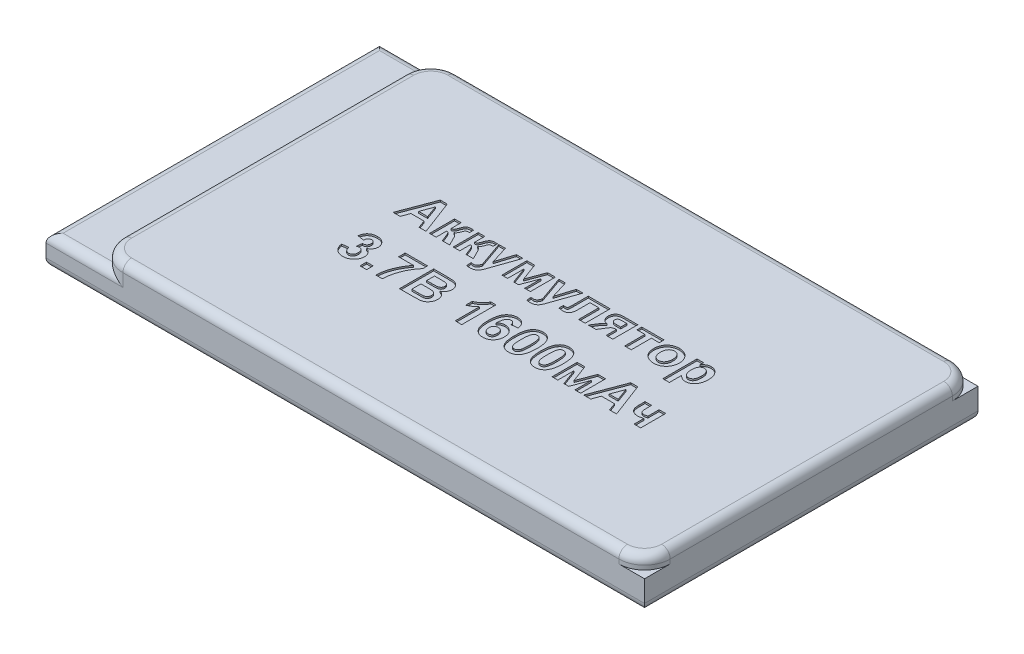
from build123d import *

# Parameters (mm, degrees)
SKETCH_1_W          = 70
SKETCH_1_H          = 39
EXTRUDE_1_DEPTH     = 3.5
EXTRUDE_2_DEPTH     = 1.5
FILLET_1_R          = 1
SKETCH_3_W          = 0.76923077
SKETCH_3_H          = 0.769230769
CUT_EXTRUDE_1_DEPTH = 0.2


with BuildPart() as part:
    # Эскиз1 → Бобышка-Вытянуть1 (new body)
    with BuildSketch(Plane(origin=(0, 0, 0), x_dir=(1, 0, 0), z_dir=(0, 1, 0))):
        Rectangle(SKETCH_1_W, SKETCH_1_H)
    extrude(amount=EXTRUDE_1_DEPTH)

    # Эскиз2 → Бобышка-Вытянуть2 (add)
    with BuildSketch(Plane(origin=(0, 3.5, 0), x_dir=(1, 0, 0), z_dir=(0, 1, 0))):
        with BuildLine():
            Line((32, 19.5), (-26, 19.5))
            ThreePointArc((-26, 19.5), (-28.121320344, 18.621320344), (-29, 16.5))
            Line((-29, 16.5), (-29, -16.5))
            ThreePointArc((-29, -16.5), (-28.121320344, -18.621320344), (-26, -19.5))
            Line((-26, -19.5), (32, -19.5))
            ThreePointArc((32, -19.5), (34.121320344, -18.621320344), (35, -16.5))
            Line((35, -16.5), (35, 16.5))
            ThreePointArc((35, 16.5), (34.121320344, 18.621320344), (32, 19.5))
        make_face()
    extrude(amount=EXTRUDE_2_DEPTH)

    # Скругление1
    fillet_1_edges = [part.edges().sort_by_distance(p)[0] for p in [
        (-35, 3.5, 0),
        (-30.5, 3.5, 19.5),
        (-30.5, 3.5, -19.5),
        (-28.121320344, 5, 18.621320344),
        (3, 5, 19.5),
        (34.121320344, 5, 18.621320344),
        (35, 5, 0),
        (34.121320344, 5, -18.621320344),
        (3, 5, -19.5),
        (-28.121320344, 5, -18.621320344),
        (-29, 5, 0),
        (0, 0, 19.5),
        (-35, 0, 0),
        (0, 0, -19.5),
        (35, 0, 0),
    ]]
    fillet(fillet_1_edges, radius=FILLET_1_R)

    # Эскиз3 → Вырез-Вытянуть1 (cut)
    # profile 1 of 22: a face of its own
    with BuildSketch(Plane(origin=(0, 5, 0), x_dir=(1, 0, 0), z_dir=(0, 1, 0))):
        Polygon((-11.467719109, 1.411937717), (-12.283424237, 1.411937717), (-12.62076398, 2.33501464), (-14.156020391, 2.33501464), (-14.493360134, 1.411937717), (-15.313872955, 1.411937717), (-13.801853724, 5.411937717), (-12.986949878, 5.411937717), align=None)
        Polygon((-12.865155006, 3.001681306), (-13.390796032, 4.437578742), (-13.914834493, 3.001681306), align=None, mode=Mode.SUBTRACT)
    # profile 2 of 22: a face of its own
    with BuildSketch(Plane(origin=(0, 5, 0), x_dir=(1, 0, 0), z_dir=(0, 1, 0))):
        with BuildLine():
            Line((-11.057462698, 4.33501464), (-10.288231929, 4.33501464))
            Line((-10.288231929, 4.33501464), (-10.288231929, 3.15552746))
            add(Edge.make_bspline(
                [(-10.288231929, 3.15552746), (-10.259478514, 3.159727434), (-10.20587527, 3.167557189), (-10.132562283, 3.191554427), (-10.073137676, 3.225315726), (-10.032199221, 3.261731768), (-10.007312381, 3.299028171), (-9.986112512, 3.332617286), (-9.964972209, 3.373583133), (-9.942369052, 3.421079335), (-9.91923965, 3.47566399), (-9.895455461, 3.537580625), (-9.869740146, 3.606109175), (-9.853023452, 3.654418683), (-9.844321673, 3.679565922)],
                knots=[0, 0, 0, 0, 1.409504292, 2.627653156, 3.719989626, 4.711159007, 5.250937278, 5.891610197, 6.640061537, 7.487095787, 8.445914578, 9.517730021, 10.707868507, 12, 12, 12, 12], degree=3))
            add(Edge.make_bspline(
                [(-9.844321673, 3.679565922), (-9.832624002, 3.713074971), (-9.810183929, 3.777356619), (-9.772783089, 3.867917588), (-9.736697423, 3.95010364), (-9.698131835, 4.022245499), (-9.659091988, 4.08515779), (-9.619042775, 4.138399528), (-9.578244947, 4.182677939), (-9.548421738, 4.206084408), (-9.534225519, 4.217226178)],
                knots=[0, 0, 0, 0, 1.353199028, 2.595891713, 3.735594176, 4.774531848, 5.712774659, 6.556157434, 7.312712971, 8, 8, 8, 8], degree=3))
            add(Edge.make_bspline(
                [(-9.534225519, 4.217226178), (-9.504615719, 4.235492225), (-9.443564518, 4.273154219), (-9.33727621, 4.308479175), (-9.21927842, 4.331678685), (-9.136117136, 4.333870719), (-9.092719109, 4.33501464)],
                knots=[0, 0, 0, 0, 0.897674631, 1.850877549, 2.878472392, 4, 4, 4, 4], degree=3))
            add(Edge.make_bspline(
                [(-9.092719109, 4.33501464), (-9.076158275, 4.334803944), (-9.037682599, 4.334314435), (-8.972478931, 4.331936203), (-8.891877238, 4.326509567), (-8.833107326, 4.323198695), (-8.801052442, 4.321392845)],
                knots=[0, 0, 0, 0, 0.680571997, 1.581168405, 2.680696244, 4, 4, 4, 4], degree=3))
            Line((-8.801052442, 4.321392845), (-8.797847314, 3.822194127))
            add(Edge.make_bspline(
                [(-8.797847314, 3.822194127), (-8.821085093, 3.822027241), (-8.865704551, 3.821706798), (-8.929345052, 3.819668596), (-8.986271213, 3.814789238), (-9.036539967, 3.808419621), (-9.080219443, 3.800701629), (-9.117634486, 3.791342521), (-9.148501882, 3.779691384), (-9.16575269, 3.769271245), (-9.173648596, 3.764501819)],
                knots=[0, 0, 0, 0, 1.451288626, 2.786656696, 3.97518474, 5.017941778, 5.950403177, 6.743379229, 7.424829267, 8, 8, 8, 8], degree=3))
            add(Edge.make_bspline(
                [(-9.173648596, 3.764501819), (-9.180851163, 3.758609463), (-9.196770713, 3.745585821), (-9.216805328, 3.718019047), (-9.238625103, 3.684571527), (-9.260020806, 3.642996823), (-9.28240365, 3.594423135), (-9.304456341, 3.538015967), (-9.327948898, 3.474874068), (-9.342372249, 3.42989797), (-9.349930647, 3.406328742)],
                knots=[0, 0, 0, 0, 0.551348947, 1.218624757, 2.011663062, 2.928210912, 3.994267905, 5.191725274, 6.528354605, 8, 8, 8, 8], degree=3))
            add(Edge.make_bspline(
                [(-9.349930647, 3.406328742), (-9.360953547, 3.374366337), (-9.382157525, 3.312882505), (-9.420253128, 3.22680086), (-9.460386231, 3.149506299), (-9.505497925, 3.082254293), (-9.554502226, 3.025271365), (-9.606126573, 2.976993289), (-9.66182433, 2.938247491), (-9.702425807, 2.920649926), (-9.722526801, 2.911937717)],
                knots=[0, 0, 0, 0, 1.26811722, 2.439387944, 3.528863152, 4.53233669, 5.470471732, 6.342865145, 7.179585093, 8, 8, 8, 8], degree=3))
            add(Edge.make_bspline(
                [(-9.722526801, 2.911937717), (-9.693839195, 2.901848178), (-9.635534054, 2.881342043), (-9.553079701, 2.833422307), (-9.474360077, 2.771776129), (-9.398790034, 2.69674464), (-9.327521062, 2.607610378), (-9.259303037, 2.505148591), (-9.194466152, 2.388736415), (-9.155974102, 2.304851331), (-9.135988339, 2.261296691)],
                knots=[0, 0, 0, 0, 0.806756492, 1.639664559, 2.519983015, 3.458613073, 4.463008027, 5.547789545, 6.72676837, 8, 8, 8, 8], degree=3))
            add(Edge.make_bspline(
                [(-9.135988339, 2.261296691), (-9.131523559, 2.251909994), (-9.1223879, 2.232703305), (-9.11229995, 2.213979016), (-9.107142185, 2.204405665)],
                knots=[0, 0, 0, 0, 0.977440432, 2, 2, 2, 2], degree=3))
            Line((-9.107142185, 2.204405665), (-8.698488339, 1.411937717))
            Line((-8.698488339, 1.411937717), (-9.556661416, 1.411937717))
            Line((-9.556661416, 1.411937717), (-9.889193468, 2.246072332))
            add(Edge.make_bspline(
                [(-9.889193468, 2.246072332), (-9.90499826, 2.28447949), (-9.933987547, 2.354926229), (-9.980017352, 2.44762604), (-10.021856599, 2.518552233), (-10.062207439, 2.570279187), (-10.108207799, 2.604207501), (-10.16016486, 2.6277978), (-10.221730701, 2.63984019), (-10.265217579, 2.641714837), (-10.288231929, 2.642706947)],
                knots=[0, 0, 0, 0, 1.632443751, 2.994242391, 4.06392943, 4.869238167, 5.551754827, 6.289542618, 7.094782897, 8, 8, 8, 8], degree=3))
            Line((-10.288231929, 2.642706947), (-10.288231929, 1.411937717))
            Line((-10.288231929, 1.411937717), (-11.057462698, 1.411937717))
            Line((-11.057462698, 1.411937717), (-11.057462698, 4.33501464))
        make_face()
    # profile 3 of 22: a face of its own
    with BuildSketch(Plane(origin=(0, 5, 0), x_dir=(1, 0, 0), z_dir=(0, 1, 0))):
        with BuildLine():
            Line((-8.288231929, 4.33501464), (-7.51900116, 4.33501464))
            Line((-7.51900116, 4.33501464), (-7.51900116, 3.15552746))
            add(Edge.make_bspline(
                [(-7.51900116, 3.15552746), (-7.490247745, 3.159727434), (-7.436644501, 3.167557189), (-7.363331514, 3.191554427), (-7.303906907, 3.225315726), (-7.262968452, 3.261731768), (-7.238081612, 3.299028171), (-7.216881743, 3.332617286), (-7.19574144, 3.373583133), (-7.173138283, 3.421079335), (-7.150008881, 3.47566399), (-7.126224692, 3.537580625), (-7.100509376, 3.606109175), (-7.083792683, 3.654418683), (-7.075090903, 3.679565922)],
                knots=[0, 0, 0, 0, 1.409504292, 2.627653156, 3.719989626, 4.711159007, 5.250937278, 5.891610197, 6.640061537, 7.487095787, 8.445914578, 9.517730021, 10.707868507, 12, 12, 12, 12], degree=3))
            add(Edge.make_bspline(
                [(-7.075090903, 3.679565922), (-7.063393233, 3.713074971), (-7.04095316, 3.777356619), (-7.00355232, 3.867917588), (-6.967466653, 3.95010364), (-6.928901066, 4.022245499), (-6.889861219, 4.08515779), (-6.849812005, 4.138399528), (-6.809014178, 4.182677939), (-6.779190968, 4.206084408), (-6.76499475, 4.217226178)],
                knots=[0, 0, 0, 0, 1.353199028, 2.595891713, 3.735594176, 4.774531848, 5.712774659, 6.556157434, 7.312712971, 8, 8, 8, 8], degree=3))
            add(Edge.make_bspline(
                [(-6.76499475, 4.217226178), (-6.735384949, 4.235492225), (-6.674333749, 4.273154219), (-6.568045441, 4.308479175), (-6.450047651, 4.331678685), (-6.366886367, 4.333870719), (-6.323488339, 4.33501464)],
                knots=[0, 0, 0, 0, 0.897674631, 1.850877549, 2.878472392, 4, 4, 4, 4], degree=3))
            add(Edge.make_bspline(
                [(-6.323488339, 4.33501464), (-6.306927505, 4.334803944), (-6.26845183, 4.334314435), (-6.203248162, 4.331936203), (-6.122646469, 4.326509567), (-6.063876557, 4.323198695), (-6.031821673, 4.321392845)],
                knots=[0, 0, 0, 0, 0.680571997, 1.581168405, 2.680696244, 4, 4, 4, 4], degree=3))
            Line((-6.031821673, 4.321392845), (-6.028616544, 3.822194127))
            add(Edge.make_bspline(
                [(-6.028616544, 3.822194127), (-6.051854324, 3.822027241), (-6.096473782, 3.821706798), (-6.160114283, 3.819668596), (-6.217040444, 3.814789238), (-6.267309198, 3.808419621), (-6.310988673, 3.800701629), (-6.348403717, 3.791342521), (-6.379271113, 3.779691384), (-6.39652192, 3.769271245), (-6.404417827, 3.764501819)],
                knots=[0, 0, 0, 0, 1.451288626, 2.786656696, 3.97518474, 5.017941778, 5.950403177, 6.743379229, 7.424829267, 8, 8, 8, 8], degree=3))
            add(Edge.make_bspline(
                [(-6.404417827, 3.764501819), (-6.411620394, 3.758609463), (-6.427539943, 3.745585821), (-6.447574559, 3.718019047), (-6.469394333, 3.684571527), (-6.490790037, 3.642996823), (-6.51317288, 3.594423135), (-6.535225572, 3.538015967), (-6.558718129, 3.474874068), (-6.57314148, 3.42989797), (-6.580699878, 3.406328742)],
                knots=[0, 0, 0, 0, 0.551348947, 1.218624757, 2.011663062, 2.928210912, 3.994267905, 5.191725274, 6.528354605, 8, 8, 8, 8], degree=3))
            add(Edge.make_bspline(
                [(-6.580699878, 3.406328742), (-6.591722778, 3.374366337), (-6.612926756, 3.312882505), (-6.651022359, 3.22680086), (-6.691155462, 3.149506299), (-6.736267156, 3.082254293), (-6.785271456, 3.025271365), (-6.836895804, 2.976993289), (-6.892593561, 2.938247491), (-6.933195038, 2.920649926), (-6.953296032, 2.911937717)],
                knots=[0, 0, 0, 0, 1.26811722, 2.439387944, 3.528863152, 4.53233669, 5.470471732, 6.342865145, 7.179585093, 8, 8, 8, 8], degree=3))
            add(Edge.make_bspline(
                [(-6.953296032, 2.911937717), (-6.924608426, 2.901848178), (-6.866303285, 2.881342043), (-6.783848932, 2.833422307), (-6.705129308, 2.771776129), (-6.629559265, 2.69674464), (-6.558290293, 2.607610378), (-6.490072268, 2.505148591), (-6.425235383, 2.388736415), (-6.386743333, 2.304851331), (-6.36675757, 2.261296691)],
                knots=[0, 0, 0, 0, 0.806756492, 1.639664559, 2.519983015, 3.458613073, 4.463008027, 5.547789545, 6.72676837, 8, 8, 8, 8], degree=3))
            add(Edge.make_bspline(
                [(-6.36675757, 2.261296691), (-6.362292789, 2.251909994), (-6.353157131, 2.232703305), (-6.343069181, 2.213979016), (-6.337911416, 2.204405665)],
                knots=[0, 0, 0, 0, 0.977440432, 2, 2, 2, 2], degree=3))
            Line((-6.337911416, 2.204405665), (-5.92925757, 1.411937717))
            Line((-5.92925757, 1.411937717), (-6.787430647, 1.411937717))
            Line((-6.787430647, 1.411937717), (-7.119962698, 2.246072332))
            add(Edge.make_bspline(
                [(-7.119962698, 2.246072332), (-7.135767491, 2.28447949), (-7.164756778, 2.354926229), (-7.210786583, 2.44762604), (-7.252625829, 2.518552233), (-7.29297667, 2.570279187), (-7.33897703, 2.604207501), (-7.390934091, 2.6277978), (-7.452499932, 2.63984019), (-7.49598681, 2.641714837), (-7.51900116, 2.642706947)],
                knots=[0, 0, 0, 0, 1.632443751, 2.994242391, 4.06392943, 4.869238167, 5.551754827, 6.289542618, 7.094782897, 8, 8, 8, 8], degree=3))
            Line((-7.51900116, 2.642706947), (-7.51900116, 1.411937717))
            Line((-7.51900116, 1.411937717), (-8.288231929, 1.411937717))
            Line((-8.288231929, 1.411937717), (-8.288231929, 4.33501464))
        make_face()
    # profile 4 of 22: a face of its own
    with BuildSketch(Plane(origin=(0, 5, 0), x_dir=(1, 0, 0), z_dir=(0, 1, 0))):
        with BuildLine():
            Line((-5.877975519, 4.33501464), (-5.10874475, 4.33501464))
            Line((-5.10874475, 4.33501464), (-4.467719109, 2.265303101))
            Line((-4.467719109, 2.265303101), (-3.826693468, 4.33501464))
            Line((-3.826693468, 4.33501464), (-3.057462698, 4.33501464))
            Line((-3.057462698, 4.33501464), (-4.029417827, 1.547354383))
            Line((-4.029417827, 1.547354383), (-4.213712698, 1.019309512))
            add(Edge.make_bspline(
                [(-4.213712698, 1.019309512), (-4.228867953, 0.981504158), (-4.257366896, 0.910412473), (-4.30278857, 0.811889481), (-4.345682321, 0.726905325), (-4.3903623, 0.655785098), (-4.434015237, 0.593589796), (-4.481859389, 0.540207347), (-4.531612358, 0.491277636), (-4.585667128, 0.448688151), (-4.644615629, 0.410914022), (-4.709601255, 0.378645006), (-4.780594464, 0.349197992), (-4.858033525, 0.325983203), (-4.940813086, 0.305978975), (-5.029198461, 0.294428907), (-5.122411447, 0.284450864), (-5.186437737, 0.283976316), (-5.219321673, 0.283732588)],
                knots=[0, 0, 0, 0, 1.442389574, 2.712364636, 3.842141792, 4.810870158, 5.685193676, 6.529785669, 7.346031511, 8.154233153, 8.962545531, 9.821428725, 10.720930479, 11.681493955, 12.682037037, 13.733651981, 14.836002494, 16, 16, 16, 16], degree=3))
            add(Edge.make_bspline(
                [(-5.219321673, 0.283732588), (-5.287088737, 0.28538574), (-5.422317543, 0.288684595), (-5.555249401, 0.31371406), (-5.621565262, 0.326200537)],
                knots=[0, 0, 0, 0, 1.002257816, 2, 2, 2, 2], degree=3))
            Line((-5.621565262, 0.326200537), (-5.672847314, 0.883892845))
            add(Edge.make_bspline(
                [(-5.672847314, 0.883892845), (-5.646456967, 0.878276366), (-5.595492803, 0.867430007), (-5.520332325, 0.856094313), (-5.449140136, 0.84954824), (-5.402827334, 0.848394415), (-5.380379365, 0.847835153)],
                knots=[0, 0, 0, 0, 1.096454798, 2.117437249, 3.087515614, 4, 4, 4, 4], degree=3))
            add(Edge.make_bspline(
                [(-5.380379365, 0.847835153), (-5.360859433, 0.848268436), (-5.323278279, 0.849102625), (-5.26868983, 0.856305394), (-5.218161894, 0.86907443), (-5.171579582, 0.886929333), (-5.128261965, 0.908325423), (-5.089415415, 0.936240966), (-5.054290749, 0.968748381), (-5.012982749, 1.019941221), (-4.967425602, 1.092341304), (-4.920505543, 1.189094069), (-4.879187111, 1.296267139), (-4.858332268, 1.372460067), (-4.847526801, 1.411937717)],
                knots=[0, 0, 0, 0, 0.826282398, 1.5908173, 2.325927711, 3.027474672, 3.700169566, 4.365407898, 5.04557163, 5.720354759, 7.144619778, 8.656909909, 10.267853154, 12, 12, 12, 12], degree=3))
            Line((-4.847526801, 1.411937717), (-5.877975519, 4.33501464))
        make_face()
    # profile 5 of 22: a face of its own
    with BuildSketch(Plane(origin=(0, 5, 0), x_dir=(1, 0, 0), z_dir=(0, 1, 0))):
        Polygon((-2.595924237, 4.33501464), (-1.687270391, 4.33501464), (-0.92925757, 2.298155665), (-0.165635775, 4.33501464), (0.737409097, 4.33501464), (0.737409097, 1.411937717), (0.07074243, 1.411937717), (0.07074243, 3.335815922), (-0.650411416, 1.411937717), (-1.213712698, 1.411937717), (-1.92925757, 3.335815922), (-1.92925757, 1.411937717), (-2.595924237, 1.411937717), align=None)
    # profile 6 of 22: a face of its own
    with BuildSketch(Plane(origin=(0, 5, 0), x_dir=(1, 0, 0), z_dir=(0, 1, 0))):
        with BuildLine():
            Line((1.147665507, 4.33501464), (1.916896276, 4.33501464))
            Line((1.916896276, 4.33501464), (2.557921917, 2.265303101))
            Line((2.557921917, 2.265303101), (3.198947558, 4.33501464))
            Line((3.198947558, 4.33501464), (3.968178327, 4.33501464))
            Line((3.968178327, 4.33501464), (2.996223199, 1.547354383))
            Line((2.996223199, 1.547354383), (2.811928327, 1.019309512))
            add(Edge.make_bspline(
                [(2.811928327, 1.019309512), (2.796773072, 0.981504158), (2.76827413, 0.910412473), (2.722852456, 0.811889481), (2.679958704, 0.726905325), (2.635278726, 0.655785098), (2.591625789, 0.593589796), (2.543781636, 0.540207347), (2.494028668, 0.491277636), (2.439973898, 0.448688151), (2.381025397, 0.410914022), (2.316039771, 0.378645006), (2.245046561, 0.349197992), (2.1676075, 0.325983203), (2.08482794, 0.305978975), (1.996442564, 0.294428907), (1.903229579, 0.284450864), (1.839203289, 0.283976316), (1.806319353, 0.283732588)],
                knots=[0, 0, 0, 0, 1.442389574, 2.712364636, 3.842141792, 4.810870158, 5.685193676, 6.529785669, 7.346031511, 8.154233153, 8.962545531, 9.821428725, 10.720930479, 11.681493955, 12.682037037, 13.733651981, 14.836002494, 16, 16, 16, 16], degree=3))
            add(Edge.make_bspline(
                [(1.806319353, 0.283732588), (1.738552289, 0.28538574), (1.603323483, 0.288684595), (1.470391625, 0.31371406), (1.404075763, 0.326200537)],
                knots=[0, 0, 0, 0, 1.002257816, 2, 2, 2, 2], degree=3))
            Line((1.404075763, 0.326200537), (1.352793712, 0.883892845))
            add(Edge.make_bspline(
                [(1.352793712, 0.883892845), (1.379184058, 0.878276366), (1.430148222, 0.867430007), (1.505308701, 0.856094313), (1.576500889, 0.84954824), (1.622813692, 0.848394415), (1.645261661, 0.847835153)],
                knots=[0, 0, 0, 0, 1.096454798, 2.117437249, 3.087515614, 4, 4, 4, 4], degree=3))
            add(Edge.make_bspline(
                [(1.645261661, 0.847835153), (1.664781593, 0.848268436), (1.702362747, 0.849102625), (1.756951196, 0.856305394), (1.807479132, 0.86907443), (1.854061443, 0.886929333), (1.897379061, 0.908325423), (1.936225611, 0.936240966), (1.971350277, 0.968748381), (2.012658277, 1.019941221), (2.058215424, 1.092341304), (2.105135483, 1.189094069), (2.146453915, 1.296267139), (2.167308758, 1.372460067), (2.178114225, 1.411937717)],
                knots=[0, 0, 0, 0, 0.826282398, 1.5908173, 2.325927711, 3.027474672, 3.700169566, 4.365407898, 5.04557163, 5.720354759, 7.144619778, 8.656909909, 10.267853154, 12, 12, 12, 12], degree=3))
            Line((2.178114225, 1.411937717), (1.147665507, 4.33501464))
        make_face()
    # profile 7 of 22: a face of its own
    with BuildSketch(Plane(origin=(0, 5, 0), x_dir=(1, 0, 0), z_dir=(0, 1, 0))):
        with BuildLine():
            Line((4.583562943, 4.33501464), (7.147665507, 4.33501464))
            Line((7.147665507, 4.33501464), (7.147665507, 1.411937717))
            Line((7.147665507, 1.411937717), (6.378434738, 1.411937717))
            Line((6.378434738, 1.411937717), (6.378434738, 3.770912076))
            Line((6.378434738, 3.770912076), (5.352793712, 3.770912076))
            Line((5.352793712, 3.770912076), (5.352793712, 2.421553101))
            add(Edge.make_bspline(
                [(5.352793712, 2.421553101), (5.352585247, 2.380146177), (5.352184243, 2.300495469), (5.346409977, 2.186112481), (5.337658185, 2.081347059), (5.326201722, 1.986025301), (5.310067958, 1.900197738), (5.291356872, 1.823662651), (5.268315981, 1.756819114), (5.233770472, 1.683084205), (5.186137375, 1.605572823), (5.1246339, 1.527808053), (5.060192807, 1.466800056), (4.988929101, 1.421730882), (4.904430358, 1.394352577), (4.80404365, 1.373587498), (4.682615643, 1.362647741), (4.594796842, 1.361352936), (4.54750525, 1.360655665)],
                knots=[0, 0, 0, 0, 1.271102602, 2.445103702, 3.514910356, 4.498429431, 5.391022703, 6.19449516, 6.915440778, 7.557452557, 8.690949558, 9.70008021, 10.593689868, 11.403788069, 12.264824949, 13.303733533, 14.548024674, 16, 16, 16, 16], degree=3))
            add(Edge.make_bspline(
                [(4.54750525, 1.360655665), (4.514903795, 1.36140464), (4.445061941, 1.363009163), (4.333102175, 1.372661263), (4.206703679, 1.38697823), (4.117713819, 1.400168057), (4.07074243, 1.407130024)],
                knots=[0, 0, 0, 0, 0.81609783, 1.748320282, 2.811499136, 4, 4, 4, 4], degree=3))
            Line((4.07074243, 1.407130024), (4.07074243, 1.938380024))
            add(Edge.make_bspline(
                [(4.07074243, 1.938380024), (4.076086505, 1.938449566), (4.090264484, 1.938634064), (4.115860696, 1.936308517), (4.151151228, 1.935202156), (4.177583452, 1.933649471), (4.192537302, 1.93277105)],
                knots=[0, 0, 0, 0, 0.525667916, 1.394611449, 2.526019291, 4, 4, 4, 4], degree=3))
            add(Edge.make_bspline(
                [(4.192537302, 1.93277105), (4.210430678, 1.931668275), (4.244073222, 1.929594875), (4.29135098, 1.927195237), (4.332217127, 1.92548752), (4.357333193, 1.924987088), (4.368819353, 1.92475823)],
                knots=[0, 0, 0, 0, 1.218985887, 2.291897617, 3.218845131, 4, 4, 4, 4], degree=3))
            add(Edge.make_bspline(
                [(4.368819353, 1.92475823), (4.391154158, 1.925684203), (4.432392988, 1.927393913), (4.487952206, 1.947195955), (4.528896876, 1.982399135), (4.54950294, 2.023420269), (4.559272069, 2.065435327), (4.564794951, 2.10953505), (4.571731781, 2.164994147), (4.576065719, 2.232134561), (4.579047995, 2.31095623), (4.58141796, 2.401510597), (4.582980489, 2.50381293), (4.5833622, 2.575932822), (4.583562943, 2.613860794)],
                knots=[0, 0, 0, 0, 0.988389366, 1.824955386, 2.564248651, 3.327756783, 3.81648387, 4.475279794, 5.298641394, 6.296861499, 7.459459269, 8.799362367, 10.316779303, 12, 12, 12, 12], degree=3))
            Line((4.583562943, 2.613860794), (4.583562943, 4.33501464))
        make_face()
    # profile 8 of 22: a face of its own
    with BuildSketch(Plane(origin=(0, 5, 0), x_dir=(1, 0, 0), z_dir=(0, 1, 0))):
        with BuildLine():
            Line((10.378434738, 4.33501464), (10.378434738, 1.411937717))
            Line((10.378434738, 1.411937717), (9.609203968, 1.411937717))
            Line((9.609203968, 1.411937717), (9.609203968, 2.591424896))
            Line((9.609203968, 2.591424896), (9.541094994, 2.591424896))
            add(Edge.make_bspline(
                [(9.541094994, 2.591424896), (9.503919283, 2.590826469), (9.434685772, 2.589711998), (9.338687037, 2.577441615), (9.257689493, 2.559955267), (9.189571131, 2.53022506), (9.129259186, 2.486555988), (9.069427883, 2.42767719), (9.006146552, 2.35178245), (8.965814067, 2.29344684), (8.944139866, 2.262097973)],
                knots=[0, 0, 0, 0, 1.230194311, 2.291030069, 3.200605757, 3.964832296, 4.732887778, 5.652428318, 6.738442733, 8, 8, 8, 8], degree=3))
            Line((8.944139866, 2.262097973), (8.899268071, 2.20600823))
            Line((8.899268071, 2.20600823), (8.415293712, 1.411937717))
            Line((8.415293712, 1.411937717), (7.506639866, 1.411937717))
            Line((7.506639866, 1.411937717), (8.046703968, 2.235655665))
            add(Edge.make_bspline(
                [(8.046703968, 2.235655665), (8.066266262, 2.264108098), (8.103866511, 2.318795887), (8.161002384, 2.394980544), (8.21765701, 2.460895406), (8.271435718, 2.518509721), (8.325673693, 2.565070748), (8.377555584, 2.603164423), (8.42813972, 2.632365808), (8.462891156, 2.644266349), (8.479396276, 2.649918486)],
                knots=[0, 0, 0, 0, 1.35954944, 2.613159733, 3.747017534, 4.780925119, 5.712887947, 6.556458323, 7.314392978, 8, 8, 8, 8], degree=3))
            add(Edge.make_bspline(
                [(8.479396276, 2.649918486), (8.453409213, 2.652021678), (8.40212613, 2.656172136), (8.328002229, 2.672043859), (8.257123028, 2.692507357), (8.190518687, 2.721085323), (8.126695888, 2.755232991), (8.06766323, 2.797445367), (8.01153822, 2.844838155), (7.960638657, 2.899474417), (7.914525549, 2.959042394), (7.873948904, 3.023128074), (7.839456133, 3.091224435), (7.811545857, 3.163488296), (7.789651747, 3.239352077), (7.774791494, 3.319336396), (7.764773286, 3.403137834), (7.763630523, 3.460518747), (7.763050122, 3.489662076)],
                knots=[0, 0, 0, 0, 1.018849207, 2.010605314, 2.959324794, 3.900477272, 4.840236824, 5.785209258, 6.733756124, 7.709421134, 8.700020803, 9.676859933, 10.672132137, 11.68107578, 12.702920665, 13.756172158, 14.860376965, 16, 16, 16, 16], degree=3))
            add(Edge.make_bspline(
                [(7.763050122, 3.489662076), (7.764426567, 3.535989815), (7.767105337, 3.626150582), (7.792514902, 3.755908468), (7.833369885, 3.875377229), (7.890295516, 3.982913368), (7.960743373, 4.07722604), (8.043448283, 4.15593064), (8.136835254, 4.219122694), (8.224491365, 4.256133127), (8.300718315, 4.279257704), (8.364981033, 4.294322706), (8.435855349, 4.307107612), (8.513412754, 4.31729679), (8.597604386, 4.32531004), (8.688221008, 4.330464133), (8.785440582, 4.335074138), (8.8525202, 4.335034936), (8.88724884, 4.33501464)],
                knots=[0, 0, 0, 0, 1.368994445, 2.664269613, 3.893486861, 5.091514517, 6.248086674, 7.360090729, 8.453445219, 9.564438564, 10.159204616, 10.80879071, 11.515394959, 12.288553695, 13.121815089, 14.016234847, 14.972959779, 16, 16, 16, 16], degree=3))
            Line((8.88724884, 4.33501464), (10.378434738, 4.33501464))
        make_face()
        with BuildLine():
            Line((9.609203968, 3.822194127), (9.07074243, 3.822194127))
            add(Edge.make_bspline(
                [(9.07074243, 3.822194127), (9.046975361, 3.821707655), (9.001023374, 3.820767095), (8.934834996, 3.818643795), (8.87432627, 3.810424166), (8.818930565, 3.802656865), (8.769431749, 3.789953657), (8.724540753, 3.77735174), (8.686343786, 3.759160346), (8.642285749, 3.734196115), (8.596442872, 3.693030288), (8.559283731, 3.628047287), (8.535132938, 3.550897108), (8.533270041, 3.494674858), (8.532280891, 3.464822332)],
                knots=[0, 0, 0, 0, 1.151375943, 2.226105906, 3.203080791, 4.106764395, 4.931778476, 5.676328304, 6.359238977, 6.973684374, 8.127310021, 9.287370255, 10.559665448, 12, 12, 12, 12], degree=3))
            add(Edge.make_bspline(
                [(8.532280891, 3.464822332), (8.533752186, 3.434681183), (8.536521662, 3.377945298), (8.563055439, 3.299433668), (8.606607988, 3.234315265), (8.657813371, 3.193158454), (8.70608453, 3.166967194), (8.7490584, 3.150420182), (8.797067048, 3.136253611), (8.850507657, 3.123896004), (8.909524678, 3.115691061), (8.973674323, 3.109269306), (9.04318225, 3.105237955), (9.091303212, 3.104585761), (9.116415507, 3.104245409)],
                knots=[0, 0, 0, 0, 1.382107206, 2.601595376, 3.759741293, 4.937516011, 5.580490367, 6.280623797, 7.049937793, 7.881164101, 8.799955218, 9.787347682, 10.845310367, 12, 12, 12, 12], degree=3))
            Line((9.116415507, 3.104245409), (9.609203968, 3.104245409))
            Line((9.609203968, 3.104245409), (9.609203968, 3.822194127))
        make_face(mode=Mode.SUBTRACT)
    # profile 9 of 22: a face of its own
    with BuildSketch(Plane(origin=(0, 5, 0), x_dir=(1, 0, 0), z_dir=(0, 1, 0))):
        Polygon((10.839973199, 4.33501464), (13.455357815, 4.33501464), (13.455357815, 3.770912076), (12.532280891, 3.770912076), (12.532280891, 1.411937717), (11.763050122, 1.411937717), (11.763050122, 3.770912076), (10.839973199, 3.770912076), align=None)
    # profile 10 of 22: a face of its own
    with BuildSketch(Plane(origin=(0, 5, 0), x_dir=(1, 0, 0), z_dir=(0, 1, 0))):
        with BuildLine():
            add(Edge.make_bspline(
                [(13.711768071, 2.914341563), (13.714236015, 2.977517201), (13.719176686, 3.103990933), (13.754467265, 3.291861045), (13.814202101, 3.475959839), (13.881066021, 3.625330268), (13.947087561, 3.739522943), (14.000404165, 3.821867879), (14.059926338, 3.898026604), (14.124435822, 3.968481748), (14.192481496, 4.034922345), (14.266459344, 4.094904216), (14.34541257, 4.149460942), (14.428570261, 4.199194381), (14.515813534, 4.242861694), (14.605522704, 4.281677502), (14.698060293, 4.313571005), (14.79278156, 4.34001966), (14.890097236, 4.361232419), (14.990034162, 4.375120734), (15.092471313, 4.384381404), (15.161533644, 4.385652386), (15.196543712, 4.386296691)],
                knots=[0, 0, 0, 0, 1.619840069, 3.242819969, 4.882696853, 6.574901176, 7.427927767, 8.263869039, 9.088735507, 9.903385011, 10.712399333, 11.525463381, 12.34252837, 13.171904741, 14.008210778, 14.842888174, 15.67691885, 16.516221154, 17.363978437, 18.229048737, 19.10224397, 20, 20, 20, 20], degree=3))
            add(Edge.make_bspline(
                [(15.196543712, 4.386296691), (15.2497585, 4.385158599), (15.354442875, 4.38291974), (15.507694894, 4.362526364), (15.653387134, 4.328928724), (15.791716207, 4.282147082), (15.922786377, 4.222176668), (16.045938347, 4.147634377), (16.162189583, 4.060707237), (16.269339806, 3.960865039), (16.367280054, 3.851543832), (16.452222799, 3.733357301), (16.524722542, 3.608591666), (16.584768348, 3.477048579), (16.630346824, 3.338033844), (16.66183498, 3.191887753), (16.682920418, 3.039152378), (16.685044539, 2.934713624), (16.686127045, 2.881488999)],
                knots=[0, 0, 0, 0, 1.076054793, 2.116819909, 3.120736197, 4.09633837, 5.065772102, 6.030360709, 7.002891056, 7.996945094, 8.988102315, 9.967288529, 10.93568283, 11.902870597, 12.887008047, 13.888537105, 14.923945207, 16, 16, 16, 16], degree=3))
            add(Edge.make_bspline(
                [(16.686127045, 2.881488999), (16.685040229, 2.827732655), (16.682912681, 2.722499454), (16.661952799, 2.568345877), (16.629542532, 2.420908057), (16.583033662, 2.280485059), (16.523116559, 2.147237987), (16.45093192, 2.020711711), (16.364567485, 1.901571623), (16.265678949, 1.791059473), (16.157144544, 1.690670873), (16.04172817, 1.601427064), (15.918037192, 1.527853948), (15.788241359, 1.465986919), (15.651005268, 1.419037122), (15.507110801, 1.385548505), (15.356667684, 1.363707562), (15.253779584, 1.361685856), (15.201351404, 1.360655665)],
                knots=[0, 0, 0, 0, 1.084306555, 2.122634113, 3.133511532, 4.127271514, 5.10202058, 6.077484774, 7.061903265, 8.065960046, 9.065303363, 10.042062392, 11.004391854, 11.964060687, 12.939122686, 13.924942149, 14.942623041, 16, 16, 16, 16], degree=3))
            add(Edge.make_bspline(
                [(15.201351404, 1.360655665), (15.136036871, 1.362795251), (15.005872537, 1.367059199), (14.813256688, 1.402034065), (14.625398547, 1.458464367), (14.474050773, 1.523417682), (14.358437685, 1.58675574), (14.276447865, 1.640071643), (14.199124123, 1.697289478), (14.128275697, 1.761351935), (14.06267983, 1.830419485), (14.001467556, 1.903823397), (13.946818438, 1.983257991), (13.897206045, 2.067280086), (13.852688249, 2.156490229), (13.815576264, 2.251133497), (13.783332724, 2.35009824), (13.756739317, 2.453609182), (13.737020533, 2.562110177), (13.722683048, 2.675253564), (13.713698444, 2.793204094), (13.712419533, 2.87346013), (13.711768071, 2.914341563)],
                knots=[0, 0, 0, 0, 1.610846835, 3.210231987, 4.81374032, 6.443368681, 7.263437361, 8.06418174, 8.855100662, 9.634539345, 10.417731031, 11.204243685, 11.990424874, 12.794120493, 13.610605693, 14.447765341, 15.300248309, 16.177865431, 17.082777535, 18.019649293, 18.991233806, 20, 20, 20, 20], degree=3))
        make_face()
        with BuildLine():
            add(Edge.make_bspline(
                [(14.48099884, 2.873476178), (14.481568942, 2.83632585), (14.482678359, 2.764031301), (14.492566257, 2.65884729), (14.507891992, 2.560073464), (14.53155919, 2.468628026), (14.560099509, 2.383275256), (14.596328333, 2.305150354), (14.637726222, 2.23277372), (14.686994338, 2.168852745), (14.740691804, 2.112269891), (14.796971963, 2.061992836), (14.856386821, 2.019182268), (14.919301305, 1.984376185), (14.98563765, 1.957952889), (15.05461299, 1.938563624), (15.126723395, 1.927173003), (15.175670522, 1.925572008), (15.200550122, 1.92475823)],
                knots=[0, 0, 0, 0, 1.334287467, 2.596523749, 3.792235791, 4.920928783, 5.98599801, 7.020725633, 8.009778093, 8.975087571, 9.91178927, 10.809031968, 11.682407688, 12.537028737, 13.385161363, 14.241880569, 15.106355953, 16, 16, 16, 16], degree=3))
            add(Edge.make_bspline(
                [(15.200550122, 1.92475823), (15.225430801, 1.925569337), (15.274380049, 1.927165077), (15.346474987, 1.938594009), (15.415269036, 1.957773818), (15.481175754, 1.984592091), (15.543927456, 2.019150672), (15.603305317, 2.06202149), (15.659544884, 2.112062518), (15.71280569, 2.168950647), (15.760648383, 2.233741997), (15.802451945, 2.305892685), (15.838679651, 2.384316642), (15.867351839, 2.47012214), (15.889721944, 2.562619981), (15.905409914, 2.662035346), (15.915217996, 2.768311055), (15.916325365, 2.841402437), (15.916896276, 2.879085153)],
                knots=[0, 0, 0, 0, 0.891374549, 1.753654511, 2.608197993, 3.445305504, 4.297756158, 5.168913853, 6.063877914, 6.991658187, 7.956416983, 8.942957645, 9.975057474, 11.046479855, 12.179282068, 13.381405243, 14.649967197, 16, 16, 16, 16], degree=3))
            add(Edge.make_bspline(
                [(15.916896276, 2.879085153), (15.916322532, 2.915966217), (15.915210373, 2.987457367), (15.905457588, 3.091348142), (15.889507563, 3.188839115), (15.867523434, 3.279831904), (15.838530834, 3.364481937), (15.802225115, 3.442006273), (15.76092325, 3.513946995), (15.712526031, 3.578060353), (15.65957871, 3.634914747), (15.603296649, 3.684924484), (15.543929698, 3.727803335), (15.481175171, 3.762359837), (15.415269195, 3.789178655), (15.346474944, 3.808358316), (15.27438006, 3.819787288), (15.225430804, 3.821383022), (15.200550122, 3.822194127)],
                knots=[0, 0, 0, 0, 1.332105243, 2.582185114, 3.76554119, 4.898206757, 5.96011018, 6.991864232, 7.986448439, 8.951336849, 9.886681577, 10.788942532, 11.667203022, 12.526603947, 13.370536632, 14.232047448, 15.101357822, 16, 16, 16, 16], degree=3))
            add(Edge.make_bspline(
                [(15.200550122, 3.822194127), (15.175670522, 3.821380349), (15.126723395, 3.819779354), (15.05461299, 3.808388733), (14.98563765, 3.788999467), (14.919301305, 3.762576171), (14.856386821, 3.727770089), (14.796971963, 3.68495952), (14.740691804, 3.634682465), (14.686994338, 3.578099611), (14.637726222, 3.514178637), (14.596328333, 3.441802003), (14.560099509, 3.363677101), (14.53155919, 3.27832433), (14.507891992, 3.186878892), (14.492566257, 3.088105067), (14.482678359, 2.982921056), (14.481568942, 2.910626507), (14.48099884, 2.873476178)],
                knots=[0, 0, 0, 0, 0.893644047, 1.758119431, 2.614838637, 3.462971263, 4.317592312, 5.190968032, 6.08821073, 7.024912429, 7.990221907, 8.979274367, 10.01400199, 11.079071217, 12.207764209, 13.403476251, 14.665712533, 16, 16, 16, 16], degree=3))
        make_face(mode=Mode.SUBTRACT)
    # profile 11 of 22: a face of its own
    with BuildSketch(Plane(origin=(0, 5, 0), x_dir=(1, 0, 0), z_dir=(0, 1, 0))):
        with BuildLine():
            Line((17.301511661, 4.33501464), (18.07074243, 4.33501464))
            Line((18.07074243, 4.33501464), (18.07074243, 3.913540281))
            add(Edge.make_bspline(
                [(18.07074243, 3.913540281), (18.093634789, 3.948379947), (18.139294839, 4.017869549), (18.223514157, 4.110430823), (18.320074735, 4.190847599), (18.426229891, 4.260588195), (18.541566052, 4.31694772), (18.664259657, 4.356926706), (18.793020128, 4.381932343), (18.880990801, 4.384825808), (18.925710379, 4.386296691)],
                knots=[0, 0, 0, 0, 0.978547196, 1.95176541, 2.927409496, 3.924956672, 4.929940552, 5.934297003, 6.949907262, 8, 8, 8, 8], degree=3))
            add(Edge.make_bspline(
                [(18.925710379, 4.386296691), (18.964780282, 4.385038516), (19.042023511, 4.382551039), (19.155448903, 4.363556289), (19.264717749, 4.333140051), (19.369440419, 4.289634322), (19.46919417, 4.232966288), (19.564222338, 4.164377115), (19.654549085, 4.083387146), (19.739512827, 3.990804106), (19.818778037, 3.888037915), (19.885327354, 3.773164207), (19.944135128, 3.650079745), (19.989665898, 3.516137291), (20.027155872, 3.373275353), (20.051713908, 3.220294231), (20.068664279, 3.05815358), (20.070037534, 2.946707434), (20.07074243, 2.889501819)],
                knots=[0, 0, 0, 0, 0.889072898, 1.757743299, 2.610499059, 3.466435503, 4.33224962, 5.216506485, 6.129460723, 7.089031016, 8.074077693, 9.077254728, 10.105421072, 11.174607073, 12.292478541, 13.464028743, 14.698278956, 16, 16, 16, 16], degree=3))
            add(Edge.make_bspline(
                [(20.07074243, 2.889501819), (20.069674164, 2.830701762), (20.067596586, 2.716346676), (20.05129044, 2.550074576), (20.025333837, 2.3937639), (19.987754832, 2.247287657), (19.938934838, 2.110735308), (19.879564938, 1.984223753), (19.809568188, 1.867649404), (19.728562206, 1.762587944), (19.640821406, 1.668144102), (19.547565647, 1.585747902), (19.449461709, 1.51647145), (19.346790479, 1.459771946), (19.239526064, 1.415503931), (19.127874098, 1.383071492), (19.011270715, 1.36445888), (18.932185333, 1.361935869), (18.892056532, 1.360655665)],
                knots=[0, 0, 0, 0, 1.306236862, 2.540385766, 3.708203967, 4.823704503, 5.895540064, 6.92555389, 7.923968911, 8.910318051, 9.867658815, 10.784332462, 11.670135407, 12.530710628, 13.384816116, 14.243178637, 15.10856933, 16, 16, 16, 16], degree=3))
            add(Edge.make_bspline(
                [(18.892056532, 1.360655665), (18.854034028, 1.361503706), (18.779386975, 1.363168609), (18.670550194, 1.383113339), (18.566246735, 1.410960675), (18.466419196, 1.4539434), (18.36882655, 1.511420989), (18.270367118, 1.584828244), (18.169438861, 1.674790531), (18.104660347, 1.743664098), (18.07074243, 1.779726178)],
                knots=[0, 0, 0, 0, 0.955731574, 1.876324221, 2.77664122, 3.668156465, 4.602053939, 5.621192777, 6.754460664, 8, 8, 8, 8], degree=3))
            Line((18.07074243, 1.779726178), (18.07074243, 0.33501464))
            Line((18.07074243, 0.33501464), (17.301511661, 0.33501464))
            Line((17.301511661, 0.33501464), (17.301511661, 4.33501464))
        make_face()
        with BuildLine():
            add(Edge.make_bspline(
                [(18.07074243, 2.923155665), (18.071469961, 2.882011978), (18.072879188, 2.80231662), (18.080484356, 2.686959126), (18.09460617, 2.579788482), (18.115850723, 2.481200706), (18.140593017, 2.390172381), (18.173070496, 2.307982005), (18.210305045, 2.233781621), (18.254001044, 2.168640973), (18.30151838, 2.111416953), (18.351803654, 2.061839731), (18.404491966, 2.019360408), (18.459795473, 1.984652336), (18.518116464, 1.958149954), (18.578764239, 1.938446434), (18.642180762, 1.927282503), (18.685284976, 1.925602857), (18.706960379, 1.92475823)],
                knots=[0, 0, 0, 0, 1.493314022, 2.892550594, 4.193549699, 5.412205958, 6.550654332, 7.612709232, 8.614154521, 9.557822924, 10.452682187, 11.309508678, 12.116407821, 12.904513946, 13.672267114, 14.435601522, 15.213325928, 16, 16, 16, 16], degree=3))
            add(Edge.make_bspline(
                [(18.706960379, 1.92475823), (18.727837749, 1.925301396), (18.769062106, 1.926373929), (18.829392143, 1.937067785), (18.887034244, 1.954787643), (18.941661246, 1.980079882), (18.99421767, 2.011205459), (19.043398207, 2.050378825), (19.089733862, 2.096129549), (19.133734954, 2.148906157), (19.173690482, 2.209663876), (19.208499805, 2.279537908), (19.236724818, 2.358538584), (19.260916403, 2.446060253), (19.278865107, 2.542884364), (19.292391183, 2.648262756), (19.300448092, 2.762773778), (19.301147946, 2.84194583), (19.301511661, 2.883091563)],
                knots=[0, 0, 0, 0, 0.791529032, 1.562949534, 2.316249717, 3.073629172, 3.841847638, 4.628495664, 5.452636043, 6.309045487, 7.231005685, 8.205446327, 9.263518226, 10.409253672, 11.647529201, 12.996330553, 14.438992312, 16, 16, 16, 16], degree=3))
            add(Edge.make_bspline(
                [(19.301511661, 2.883091563), (19.301239829, 2.921574648), (19.300714247, 2.995981043), (19.291322958, 3.103741983), (19.27799513, 3.20380887), (19.260045731, 3.296703407), (19.23527712, 3.381707971), (19.20479228, 3.458881134), (19.169589731, 3.528712807), (19.128466593, 3.590422095), (19.083828526, 3.644872854), (19.035905581, 3.692042432), (18.98547901, 3.732151595), (18.932519266, 3.765609836), (18.876386082, 3.790222027), (18.818343234, 3.809418418), (18.756984909, 3.819494001), (18.715271006, 3.821286231), (18.694139866, 3.822194127)],
                knots=[0, 0, 0, 0, 1.476295784, 2.854392948, 4.147416206, 5.349490113, 6.481481629, 7.53974865, 8.529905565, 9.47655935, 10.379475707, 11.227490418, 12.051885202, 12.848277861, 13.623614998, 14.398342141, 15.188643247, 16, 16, 16, 16], degree=3))
            add(Edge.make_bspline(
                [(18.694139866, 3.822194127), (18.672178469, 3.821759819), (18.629018343, 3.820906284), (18.565976711, 3.808733345), (18.50535288, 3.791387832), (18.447393861, 3.766454695), (18.392800597, 3.73400971), (18.340622703, 3.69513138), (18.292196942, 3.648420104), (18.246159006, 3.595372035), (18.204311289, 3.53519433), (18.168470983, 3.467530192), (18.138008608, 3.393433628), (18.113176766, 3.312699341), (18.094030984, 3.225041748), (18.081038372, 3.130450412), (18.071524644, 3.029116419), (18.071008792, 2.959237827), (18.07074243, 2.923155665)],
                knots=[0, 0, 0, 0, 0.85780786, 1.685826084, 2.502493326, 3.321563322, 4.145881477, 4.981773268, 5.861261435, 6.772452983, 7.726031601, 8.721727942, 9.761775197, 10.855694188, 12.021877455, 13.2675473, 14.589084357, 16, 16, 16, 16], degree=3))
        make_face(mode=Mode.SUBTRACT)
    # profile 12 of 22: a face of its own
    with BuildSketch(Plane(origin=(0, 5, 0), x_dir=(1, 0, 0), z_dir=(0, 1, 0))):
        with BuildLine():
            Line((-15.10874475, -4.810818694), (-14.33951398, -4.716267412))
            add(Edge.make_bspline(
                [(-14.33951398, -4.716267412), (-14.332870874, -4.763565779), (-14.320261324, -4.853344745), (-14.28094424, -4.977610226), (-14.229617754, -5.08574795), (-14.161664061, -5.174350894), (-14.083098154, -5.244818583), (-13.995479004, -5.295099844), (-13.899599169, -5.326808163), (-13.832817323, -5.330012525), (-13.798648596, -5.331652027)],
                knots=[0, 0, 0, 0, 1.26631894, 2.403651751, 3.447242243, 4.428907923, 5.348362865, 6.231623936, 7.095215805, 8, 8, 8, 8], degree=3))
            add(Edge.make_bspline(
                [(-13.798648596, -5.331652027), (-13.780189789, -5.331255634), (-13.743625776, -5.330470441), (-13.689875742, -5.322232227), (-13.638230393, -5.308690564), (-13.589199284, -5.289205121), (-13.542548351, -5.264994192), (-13.497663277, -5.236162269), (-13.456429597, -5.200152396), (-13.416172208, -5.160753781), (-13.380447343, -5.115904974), (-13.348977992, -5.067245899), (-13.321354151, -5.015259184), (-13.299942842, -4.958604414), (-13.283182592, -4.89850881), (-13.271200617, -4.834711507), (-13.263908397, -4.767452987), (-13.263036085, -4.721360887), (-13.262590903, -4.697837924)],
                knots=[0, 0, 0, 0, 0.951760839, 1.885289532, 2.797832748, 3.70117291, 4.60103766, 5.506897018, 6.445598779, 7.420035506, 8.410036365, 9.396193293, 10.407074535, 11.440988179, 12.514285005, 13.622404236, 14.786601276, 16, 16, 16, 16], degree=3))
            add(Edge.make_bspline(
                [(-13.262590903, -4.697837924), (-13.264258422, -4.654180709), (-13.267439396, -4.570899809), (-13.292019795, -4.452746761), (-13.334646599, -4.348885437), (-13.39436884, -4.261179059), (-13.465335857, -4.190625863), (-13.54483354, -4.137592422), (-13.633613242, -4.107125109), (-13.695331428, -4.102978915), (-13.726533211, -4.100882796)],
                knots=[0, 0, 0, 0, 1.241512862, 2.368321189, 3.414110003, 4.41529485, 5.36642979, 6.245396713, 7.112955941, 8, 8, 8, 8], degree=3))
            add(Edge.make_bspline(
                [(-13.726533211, -4.100882796), (-13.748746941, -4.101451205), (-13.795837704, -4.102656173), (-13.869084837, -4.115175922), (-13.948961153, -4.132453742), (-14.003350853, -4.149073859), (-14.031821673, -4.157773822)],
                knots=[0, 0, 0, 0, 0.854525515, 1.811503923, 2.854410343, 4, 4, 4, 4], degree=3))
            Line((-14.031821673, -4.157773822), (-13.959706288, -3.536780232))
            add(Edge.make_bspline(
                [(-13.959706288, -3.536780232), (-13.938329877, -3.537146926), (-13.896849054, -3.537858494), (-13.836274608, -3.532836316), (-13.779575059, -3.52366694), (-13.726882706, -3.508789677), (-13.678148485, -3.49074052), (-13.632946176, -3.468063098), (-13.592381629, -3.439842217), (-13.542991663, -3.397242946), (-13.492461262, -3.33341049), (-13.446778583, -3.245881855), (-13.42132511, -3.146080704), (-13.418104659, -3.076180707), (-13.416437057, -3.03998536)],
                knots=[0, 0, 0, 0, 0.916749589, 1.778948191, 2.604102396, 3.376994206, 4.124053722, 4.831292757, 5.54010828, 6.238660037, 7.62386988, 9.002523041, 10.447858069, 12, 12, 12, 12], degree=3))
            add(Edge.make_bspline(
                [(-13.416437057, -3.03998536), (-13.417561355, -3.009163982), (-13.419717114, -2.950066218), (-13.439055733, -2.865972835), (-13.472062736, -2.791728785), (-13.518231996, -2.728622801), (-13.574866187, -2.67737881), (-13.641062662, -2.639513234), (-13.716884198, -2.617432559), (-13.770189758, -2.614977246), (-13.797847314, -2.613703309)],
                knots=[0, 0, 0, 0, 1.146968804, 2.199229744, 3.192297141, 4.153502289, 5.090509175, 6.0173182, 6.971286811, 8, 8, 8, 8], degree=3))
            add(Edge.make_bspline(
                [(-13.797847314, -2.613703309), (-13.825574562, -2.615073951), (-13.880076726, -2.617768157), (-13.958065368, -2.644418133), (-14.030014071, -2.685652031), (-14.093503633, -2.744702807), (-14.148531412, -2.818146813), (-14.191173968, -2.907717386), (-14.221204895, -3.012011229), (-14.231525958, -3.087075883), (-14.236949878, -3.126523822)],
                knots=[0, 0, 0, 0, 0.889956214, 1.749345552, 2.62404616, 3.543272128, 4.520224035, 5.562553653, 6.719074424, 8, 8, 8, 8], degree=3))
            Line((-14.236949878, -3.126523822), (-15.006180647, -3.011139206))
            add(Edge.make_bspline(
                [(-15.006180647, -3.011139206), (-14.993496869, -2.95241012), (-14.969217275, -2.839989493), (-14.919610384, -2.682479725), (-14.861404083, -2.543434945), (-14.793398628, -2.421296971), (-14.712844738, -2.313915312), (-14.617202617, -2.220708138), (-14.507903234, -2.138970797), (-14.385155293, -2.070482073), (-14.251692734, -2.01558791), (-14.109656291, -1.974959315), (-13.95940822, -1.951675485), (-13.856687551, -1.948604244), (-13.80425757, -1.947036642)],
                knots=[0, 0, 0, 0, 1.220808349, 2.336900656, 3.3513467, 4.279992853, 5.171472476, 6.069835959, 6.985198729, 7.938095762, 8.919113729, 9.91246339, 10.934493858, 12, 12, 12, 12], degree=3))
            add(Edge.make_bspline(
                [(-13.80425757, -1.947036642), (-13.759330401, -1.948058963), (-13.6715508, -1.950056394), (-13.543547338, -1.967243889), (-13.422434275, -1.995165166), (-13.308042776, -2.034661748), (-13.199842562, -2.084950025), (-13.099639937, -2.148221092), (-13.005332821, -2.221252863), (-12.94947363, -2.278089462), (-12.92124475, -2.306812283)],
                knots=[0, 0, 0, 0, 1.096978699, 2.143298912, 3.148181587, 4.128190255, 5.094201205, 6.055441919, 7.017302331, 8, 8, 8, 8], degree=3))
            add(Edge.make_bspline(
                [(-12.92124475, -2.306812283), (-12.899439728, -2.33128841), (-12.856372547, -2.379631298), (-12.800455614, -2.457137631), (-12.753656149, -2.537673707), (-12.713958102, -2.619559105), (-12.684436175, -2.704692662), (-12.662427343, -2.791737996), (-12.649354875, -2.881466383), (-12.647924524, -2.942187287), (-12.647206288, -2.972677668)],
                knots=[0, 0, 0, 0, 1.065582675, 2.104636323, 3.101288825, 4.092056841, 5.059084899, 6.026073946, 7.008813224, 8, 8, 8, 8], degree=3))
            add(Edge.make_bspline(
                [(-12.647206288, -2.972677668), (-12.648773008, -3.01556444), (-12.651861302, -3.100102154), (-12.680200162, -3.22307943), (-12.725748409, -3.339331587), (-12.788728594, -3.44930271), (-12.870840126, -3.551972306), (-12.971922428, -3.646416571), (-13.089005273, -3.736239544), (-13.177005455, -3.786976813), (-13.222526801, -3.81322254)],
                knots=[0, 0, 0, 0, 0.957571776, 1.887550067, 2.804499428, 3.740591036, 4.709432777, 5.731457079, 6.826512349, 8, 8, 8, 8], degree=3))
            add(Edge.make_bspline(
                [(-13.222526801, -3.81322254), (-13.195439286, -3.819751243), (-13.141986115, -3.832634666), (-13.064766572, -3.858899882), (-12.992450131, -3.892591066), (-12.923265633, -3.929609735), (-12.858929968, -3.973506352), (-12.798196083, -4.022146689), (-12.743386684, -4.07833997), (-12.690867004, -4.137708339), (-12.644958093, -4.202862716), (-12.603476427, -4.270662825), (-12.570157512, -4.342762912), (-12.541659791, -4.417309157), (-12.520425503, -4.495506478), (-12.503797598, -4.576769833), (-12.495463141, -4.66160503), (-12.494066542, -4.719191233), (-12.493360134, -4.748318694)],
                knots=[0, 0, 0, 0, 1.037381978, 2.047118658, 3.030848314, 4.005687143, 4.965748246, 5.927353932, 6.897971669, 7.885165084, 8.876109723, 9.862099733, 10.840989857, 11.829385213, 12.830906716, 13.855042526, 14.915067134, 16, 16, 16, 16], degree=3))
            add(Edge.make_bspline(
                [(-12.493360134, -4.748318694), (-12.494257769, -4.79086087), (-12.496028025, -4.874759761), (-12.515472124, -4.99789325), (-12.545013664, -5.116232622), (-12.585724526, -5.230255961), (-12.640169871, -5.338568188), (-12.705274867, -5.442688825), (-12.782812839, -5.541580716), (-12.871231016, -5.634494443), (-12.967843417, -5.719536729), (-13.071653125, -5.794234782), (-13.181122107, -5.857457267), (-13.296877592, -5.909153421), (-13.417913013, -5.949376547), (-13.545270309, -5.977021647), (-13.677916406, -5.995465196), (-13.768670424, -5.997358809), (-13.814674237, -5.998318694)],
                knots=[0, 0, 0, 0, 1.006520189, 1.984993146, 2.943645202, 3.891894145, 4.845023195, 5.808336607, 6.795092628, 7.815033679, 8.841288157, 9.838185905, 10.83832808, 11.829129029, 12.835072876, 13.85234392, 14.911338897, 16, 16, 16, 16], degree=3))
            add(Edge.make_bspline(
                [(-13.814674237, -5.998318694), (-13.858269469, -5.997587816), (-13.943900771, -5.9961522), (-14.069257862, -5.979145005), (-14.189321969, -5.954125419), (-14.303392294, -5.917524457), (-14.412462483, -5.872442328), (-14.514473875, -5.814326988), (-14.612052396, -5.748274084), (-14.702010064, -5.670898382), (-14.785651238, -5.586566784), (-14.859119992, -5.493825579), (-14.924590445, -5.395634747), (-14.980901301, -5.291123756), (-15.027580672, -5.180021027), (-15.06392702, -5.06261334), (-15.092913932, -4.93926023), (-15.103395094, -4.854222519), (-15.10874475, -4.810818694)],
                knots=[0, 0, 0, 0, 1.077528213, 2.11651914, 3.123276654, 4.10732375, 5.075386463, 6.036572488, 7.005896639, 7.98540975, 8.966414275, 9.939311093, 10.906719916, 11.882103104, 12.870994428, 13.882228509, 14.919075059, 16, 16, 16, 16], degree=3))
        make_face()
    # profile 13 of 22: a face of its own
    with BuildSketch(Plane(origin=(0, 5, 0), x_dir=(1, 0, 0), z_dir=(0, 1, 0))):
        with Locations((-11.442078083, -5.562421258)):
            Rectangle(SKETCH_3_W, SKETCH_3_H)
    # profile 14 of 22: a face of its own
    with BuildSketch(Plane(origin=(0, 5, 0), x_dir=(1, 0, 0), z_dir=(0, 1, 0))):
        with BuildLine():
            Line((-10.493360134, -2.767549463), (-10.493360134, -1.998318694))
            Line((-10.493360134, -1.998318694), (-7.877975519, -1.998318694))
            Line((-7.877975519, -1.998318694), (-7.877975519, -2.562421258))
            add(Edge.make_bspline(
                [(-7.877975519, -2.562421258), (-7.905258916, -2.590181224), (-7.961345744, -2.647247741), (-8.041684638, -2.740642771), (-8.123213863, -2.841992767), (-8.20422856, -2.952663418), (-8.28724703, -3.070906487), (-8.368620903, -3.198988622), (-8.451152217, -3.335248213), (-8.562265461, -3.527987676), (-8.692142978, -3.779764968), (-8.82954652, -4.092737002), (-8.946608047, -4.415320694), (-9.026766641, -4.690185781), (-9.080926675, -4.910489726), (-9.11631222, -5.071581192), (-9.14609934, -5.228139333), (-9.170331141, -5.380439298), (-9.188416017, -5.528550566), (-9.202706153, -5.671958204), (-9.209756304, -5.811011916), (-9.210796628, -5.902158657), (-9.211308852, -5.947036642)],
                knots=[0, 0, 0, 0, 0.628545797, 1.29210959, 1.98878689, 2.729126096, 3.507039704, 4.322017351, 5.179550397, 6.080149501, 7.915136253, 9.752312618, 11.597470118, 13.454141581, 14.373891568, 15.261584755, 16.117868869, 16.947726723, 17.752002974, 18.527724242, 19.275094557, 20, 20, 20, 20], degree=3))
            Line((-9.211308852, -5.947036642), (-9.980539621, -5.947036642))
            add(Edge.make_bspline(
                [(-9.980539621, -5.947036642), (-9.977967487, -5.878891829), (-9.972794645, -5.741845166), (-9.953440712, -5.536142594), (-9.923043279, -5.329674076), (-9.885287627, -5.121962424), (-9.835440754, -4.913513304), (-9.7785502, -4.703554557), (-9.709635848, -4.493207569), (-9.632384709, -4.282874536), (-9.547103512, -4.0745524), (-9.454159007, -3.870825031), (-9.353791464, -3.672963436), (-9.247306144, -3.480272428), (-9.133464242, -3.293371905), (-9.012180048, -3.112464824), (-8.885173949, -2.936242565), (-8.794363072, -2.823771022), (-8.748969109, -2.767549463)],
                knots=[0, 0, 0, 0, 0.943249748, 1.896978291, 2.856365892, 3.829648507, 4.816416106, 5.820376826, 6.838120354, 7.877341886, 8.919613352, 9.951365796, 10.974227495, 11.988073359, 12.996274698, 14.000568529, 15.000536908, 16, 16, 16, 16], degree=3))
            Line((-8.748969109, -2.767549463), (-10.493360134, -2.767549463))
        make_face()
    # profile 15 of 22: a face of its own
    with BuildSketch(Plane(origin=(0, 5, 0), x_dir=(1, 0, 0), z_dir=(0, 1, 0))):
        with BuildLine():
            Line((-7.211308852, -1.947036642), (-5.599930647, -1.947036642))
            add(Edge.make_bspline(
                [(-5.599930647, -1.947036642), (-5.561202353, -1.947267074), (-5.486413584, -1.947712065), (-5.377949613, -1.948952204), (-5.277273631, -1.952594191), (-5.184228867, -1.955721544), (-5.099124777, -1.963035123), (-5.021292497, -1.968781131), (-4.95097708, -1.976686142), (-4.868143687, -1.989478797), (-4.771823082, -2.00937687), (-4.663031317, -2.046182922), (-4.559907392, -2.092168484), (-4.464001356, -2.150632089), (-4.374994632, -2.21900895), (-4.292206495, -2.296754439), (-4.219455774, -2.387010183), (-4.153944899, -2.485517346), (-4.098649038, -2.592358661), (-4.060570989, -2.707298644), (-4.03627065, -2.828229853), (-4.033325307, -2.911126903), (-4.031821673, -2.953446899)],
                knots=[0, 0, 0, 0, 1.096610875, 2.117681168, 3.071055591, 3.949137991, 4.753059115, 5.489127199, 6.15892391, 6.75575099, 7.862330316, 8.938514814, 10.001276227, 11.05313779, 12.110449801, 13.174958802, 14.260456508, 15.384725817, 16.521138801, 17.654729897, 18.802709851, 20, 20, 20, 20], degree=3))
            add(Edge.make_bspline(
                [(-4.031821673, -2.953446899), (-4.033381154, -2.999532303), (-4.036456106, -3.090402496), (-4.065077103, -3.223654604), (-4.110667024, -3.351145953), (-4.175033445, -3.470808325), (-4.253869229, -3.580619836), (-4.347118788, -3.677047666), (-4.453411995, -3.759505517), (-4.533225691, -3.800536804), (-4.573488339, -3.82123536)],
                knots=[0, 0, 0, 0, 1.023065178, 2.01725758, 3.014298905, 4.023406433, 5.026736079, 6.009055718, 6.99565244, 8, 8, 8, 8], degree=3))
            add(Edge.make_bspline(
                [(-4.573488339, -3.82123536), (-4.546370675, -3.830471906), (-4.492752077, -3.848734934), (-4.416005304, -3.882271072), (-4.344097733, -3.921162818), (-4.277065474, -3.964183787), (-4.214399774, -4.011648476), (-4.15793148, -4.065130703), (-4.104420409, -4.121587715), (-4.057441839, -4.183853487), (-4.014919024, -4.248949941), (-3.978823509, -4.317895973), (-3.947567799, -4.38903325), (-3.92142807, -4.463081729), (-3.902795006, -4.540538052), (-3.887865035, -4.620426468), (-3.880227278, -4.70330066), (-3.878732267, -4.759257267), (-3.877975519, -4.787581514)],
                knots=[0, 0, 0, 0, 1.072651974, 2.1209089, 3.132484228, 4.131466326, 5.101889999, 6.071643115, 7.041396231, 8.011819904, 8.988565287, 9.95070344, 10.922775742, 11.897213062, 12.887138018, 13.903598663, 14.938838629, 16, 16, 16, 16], degree=3))
            add(Edge.make_bspline(
                [(-3.877975519, -4.787581514), (-3.879585031, -4.832813393), (-3.882796626, -4.92306835), (-3.906796471, -5.0577095), (-3.947329884, -5.18997938), (-4.002220492, -5.319019909), (-4.070400682, -5.440694673), (-4.150556897, -5.551783514), (-4.2440781, -5.648441504), (-4.347644743, -5.733611271), (-4.464348749, -5.804119694), (-4.594090409, -5.858280056), (-4.73604984, -5.899197146), (-4.836059587, -5.912789445), (-4.887590903, -5.919793053)],
                knots=[0, 0, 0, 0, 0.975059807, 1.945618526, 2.93861228, 3.952760547, 4.963632603, 5.940527786, 6.897802811, 7.855787948, 8.824773195, 9.82606706, 10.879852914, 12, 12, 12, 12], degree=3))
            add(Edge.make_bspline(
                [(-4.887590903, -5.919793053), (-4.907350848, -5.921459911), (-4.952711323, -5.925286311), (-5.029640164, -5.930043567), (-5.124227989, -5.933639522), (-5.236392666, -5.937891284), (-5.366479488, -5.940961181), (-5.514192803, -5.943057505), (-5.679784652, -5.945778121), (-5.795976493, -5.946602613), (-5.857142185, -5.947036642)],
                knots=[0, 0, 0, 0, 0.490565993, 1.126131979, 1.906526787, 2.832178623, 3.902933831, 5.125497984, 6.486805064, 8, 8, 8, 8], degree=3))
            Line((-5.857142185, -5.947036642), (-7.211308852, -5.947036642))
            Line((-7.211308852, -5.947036642), (-7.211308852, -1.947036642))
        make_face()
        with BuildLine():
            Line((-6.442078083, -2.613703309), (-6.442078083, -3.536780232))
            Line((-6.442078083, -3.536780232), (-5.885187057, -3.536780232))
            add(Edge.make_bspline(
                [(-5.885187057, -3.536780232), (-5.845923889, -3.536866733), (-5.771135897, -3.537031499), (-5.664834785, -3.535927373), (-5.570010143, -3.535411919), (-5.486934592, -3.533899139), (-5.415625189, -3.53140249), (-5.356338872, -3.528909384), (-5.308733049, -3.527021815), (-5.281013283, -3.52432645), (-5.26900116, -3.523158437)],
                knots=[0, 0, 0, 0, 1.528479216, 2.911428072, 4.138414629, 5.21998762, 6.145918986, 6.915989543, 7.530253335, 8, 8, 8, 8], degree=3))
            add(Edge.make_bspline(
                [(-5.26900116, -3.523158437), (-5.234360075, -3.517945742), (-5.167782035, -3.507927262), (-5.07461672, -3.478570759), (-4.993808149, -3.436112), (-4.924459322, -3.383262054), (-4.869410821, -3.318421361), (-4.829013731, -3.243831093), (-4.805378463, -3.159177822), (-4.802530424, -3.099698274), (-4.801052442, -3.068831514)],
                knots=[0, 0, 0, 0, 1.162079002, 2.233444551, 3.225172046, 4.179556897, 5.110707885, 6.027301426, 6.976273101, 8, 8, 8, 8], degree=3))
            add(Edge.make_bspline(
                [(-4.801052442, -3.068831514), (-4.801980224, -3.039025436), (-4.803761336, -2.981805176), (-4.825886869, -2.900789221), (-4.859150943, -2.828030403), (-4.907774156, -2.765316228), (-4.968788781, -2.712353427), (-5.043467499, -2.670982202), (-5.131451702, -2.642514881), (-5.194827265, -2.632558115), (-5.228135775, -2.627325104)],
                knots=[0, 0, 0, 0, 1.044241546, 2.004684189, 2.928111627, 3.838334562, 4.769594837, 5.748424953, 6.81663206, 8, 8, 8, 8], degree=3))
            add(Edge.make_bspline(
                [(-5.228135775, -2.627325104), (-5.241216727, -2.626153553), (-5.272142439, -2.623383797), (-5.32589171, -2.621583253), (-5.394257618, -2.619049106), (-5.477588641, -2.616575908), (-5.575887033, -2.615065883), (-5.68887323, -2.614556953), (-5.816542187, -2.613448005), (-5.906554279, -2.613615069), (-5.954097314, -2.613703309)],
                knots=[0, 0, 0, 0, 0.433943041, 1.02591908, 1.776648879, 2.694999143, 3.780816848, 5.02540149, 6.428861738, 8, 8, 8, 8], degree=3))
            Line((-5.954097314, -2.613703309), (-6.442078083, -2.613703309))
        make_face(mode=Mode.SUBTRACT)
        with BuildLine():
            Line((-6.442078083, -4.203446899), (-6.442078083, -5.280369976))
            Line((-6.442078083, -5.280369976), (-5.656821673, -5.280369976))
            add(Edge.make_bspline(
                [(-5.656821673, -5.280369976), (-5.620227979, -5.280551499), (-5.55077575, -5.280896018), (-5.451697766, -5.278588475), (-5.363250811, -5.277827593), (-5.285020913, -5.274031512), (-5.217419156, -5.271159816), (-5.16016738, -5.267579764), (-5.113712606, -5.261886449), (-5.08629852, -5.257466442), (-5.074289621, -5.255530232)],
                knots=[0, 0, 0, 0, 1.504773752, 2.85595359, 4.075347731, 5.141676974, 6.076328919, 6.858106537, 7.499786952, 8, 8, 8, 8], degree=3))
            add(Edge.make_bspline(
                [(-5.074289621, -5.255530232), (-5.043793173, -5.249095687), (-4.984540951, -5.236593868), (-4.902418136, -5.200719807), (-4.828403087, -5.155224986), (-4.764300332, -5.09675461), (-4.71161119, -5.026708707), (-4.673565883, -4.944932993), (-4.650622002, -4.852389598), (-4.648378309, -4.787186203), (-4.647206288, -4.753126386)],
                knots=[0, 0, 0, 0, 1.031056579, 2.003262591, 2.954260215, 3.900917722, 4.862741126, 5.841340256, 6.872396835, 8, 8, 8, 8], degree=3))
            add(Edge.make_bspline(
                [(-4.647206288, -4.753126386), (-4.648152139, -4.723917161), (-4.649993128, -4.667064815), (-4.668013943, -4.585634743), (-4.697165555, -4.511181005), (-4.737762817, -4.444211677), (-4.788484128, -4.383885685), (-4.851185872, -4.333401268), (-4.923576492, -4.291339857), (-4.992586074, -4.263630272), (-5.058025046, -4.245852923), (-5.120440088, -4.234190634), (-5.195662969, -4.224959047), (-5.283329011, -4.217150147), (-5.383793956, -4.210905486), (-5.496787802, -4.205982606), (-5.622625865, -4.203922186), (-5.710774382, -4.203610359), (-5.756981929, -4.203446899)],
                knots=[0, 0, 0, 0, 0.992165387, 1.931134082, 2.820086661, 3.700270762, 4.583075858, 5.486803518, 6.423132184, 7.421722103, 8.005700193, 8.727213115, 9.57900282, 10.582332745, 11.720121093, 13.002085041, 14.428489784, 16, 16, 16, 16], degree=3))
            Line((-5.756981929, -4.203446899), (-6.442078083, -4.203446899))
        make_face(mode=Mode.SUBTRACT)
    # profile 16 of 22: a face of its own
    with BuildSketch(Plane(origin=(0, 5, 0), x_dir=(1, 0, 0), z_dir=(0, 1, 0))):
        with BuildLine():
            Line((0.07074243, -5.947036642), (-0.698488339, -5.947036642))
            Line((-0.698488339, -5.947036642), (-0.698488339, -3.099280232))
            add(Edge.make_bspline(
                [(-0.698488339, -3.099280232), (-0.73335401, -3.134675392), (-0.802612361, -3.204985538), (-0.913228859, -3.303058817), (-1.028065648, -3.394292825), (-1.148259143, -3.477821004), (-1.27223811, -3.554833486), (-1.401269542, -3.62472261), (-1.534418176, -3.688455391), (-1.626655999, -3.724072117), (-1.672847314, -3.741908437)],
                knots=[0, 0, 0, 0, 1.012567276, 2.011397996, 3.011400399, 4.000747768, 4.993445519, 5.985067596, 6.990952157, 8, 8, 8, 8], degree=3))
            Line((-1.672847314, -3.741908437), (-1.672847314, -2.972677668))
            add(Edge.make_bspline(
                [(-1.672847314, -2.972677668), (-1.62161882, -2.953469181), (-1.514401569, -2.913267313), (-1.356184962, -2.827755901), (-1.191042557, -2.721884146), (-1.05231351, -2.618048472), (-0.94216835, -2.52573026), (-0.865185257, -2.451520903), (-0.793855995, -2.375526672), (-0.730861688, -2.295294752), (-0.674548708, -2.212447256), (-0.624652952, -2.127119528), (-0.580733217, -2.039042024), (-0.557741543, -1.977706805), (-0.54624475, -1.947036642)],
                knots=[0, 0, 0, 0, 1.253673617, 2.623841347, 4.114270668, 5.751233548, 6.594491912, 7.409089316, 8.202422231, 8.983165545, 9.746111525, 10.498431446, 11.249153235, 12, 12, 12, 12], degree=3))
            Line((-0.54624475, -1.947036642), (0.07074243, -1.947036642))
            Line((0.07074243, -1.947036642), (0.07074243, -5.947036642))
        make_face()
    # profile 17 of 22: a face of its own
    with BuildSketch(Plane(origin=(0, 5, 0), x_dir=(1, 0, 0), z_dir=(0, 1, 0))):
        with BuildLine():
            Line((3.711768071, -2.991107155), (2.942537302, -3.07524177))
            add(Edge.make_bspline(
                [(2.942537302, -3.07524177), (2.937383706, -3.038192213), (2.927685581, -2.968471714), (2.89896023, -2.872257473), (2.858971294, -2.791316739), (2.807641618, -2.725536342), (2.746502566, -2.674909016), (2.676837916, -2.638935214), (2.598691946, -2.617580288), (2.543903089, -2.615028385), (2.515453968, -2.613703309)],
                knots=[0, 0, 0, 0, 1.280716388, 2.410074291, 3.425374506, 4.35753932, 5.248331359, 6.12451615, 7.026154803, 8, 8, 8, 8], degree=3))
            add(Edge.make_bspline(
                [(2.515453968, -2.613703309), (2.496161831, -2.614175044), (2.457771452, -2.615113772), (2.401851201, -2.627031885), (2.347937353, -2.644718443), (2.29646992, -2.669767724), (2.247192108, -2.702089177), (2.200853058, -2.742069133), (2.15532237, -2.787600156), (2.113279943, -2.842581001), (2.072945127, -2.907682179), (2.038215219, -2.987378301), (2.007260428, -3.081595323), (1.980756504, -3.190794696), (1.956704463, -3.314283293), (1.93698862, -3.452561008), (1.921212117, -3.605752079), (1.913643515, -3.713036588), (1.909684738, -3.769152027)],
                knots=[0, 0, 0, 0, 0.642458078, 1.278459126, 1.898279436, 2.531842133, 3.181731979, 3.858193002, 4.57010051, 5.325711302, 6.161524323, 7.118599443, 8.217371811, 9.466325973, 10.864147948, 12.412648259, 14.123626419, 16, 16, 16, 16], degree=3))
            add(Edge.make_bspline(
                [(1.909684738, -3.769152027), (1.934269458, -3.742449781), (1.982477509, -3.690089486), (2.062469879, -3.621823691), (2.14627379, -3.563460998), (2.234801147, -3.515579577), (2.328535163, -3.479947609), (2.425777921, -3.452892941), (2.527802335, -3.437738245), (2.597137697, -3.435404435), (2.632441148, -3.434216129)],
                knots=[0, 0, 0, 0, 1.057745406, 2.074127497, 3.059409796, 4.031705469, 5.000875988, 5.977809597, 6.970362319, 8, 8, 8, 8], degree=3))
            add(Edge.make_bspline(
                [(2.632441148, -3.434216129), (2.672284035, -3.435363603), (2.750959586, -3.437629454), (2.866866936, -3.453521674), (2.978087652, -3.482098741), (3.085124875, -3.520756304), (3.18850763, -3.569435814), (3.286258313, -3.631056807), (3.379911354, -3.702904116), (3.468178746, -3.784988795), (3.549275253, -3.875357132), (3.620875448, -3.972962083), (3.679800056, -4.078101717), (3.730173537, -4.188422111), (3.76765333, -4.306101113), (3.794859698, -4.429445324), (3.811099983, -4.559586941), (3.813237825, -4.648379269), (3.814332173, -4.693831514)],
                knots=[0, 0, 0, 0, 0.99135015, 1.957564468, 2.903754199, 3.843479786, 4.78583385, 5.741106244, 6.712813504, 7.719198368, 8.735844933, 9.730198001, 10.724351158, 11.729813921, 12.742848014, 13.790983496, 14.86921809, 16, 16, 16, 16], degree=3))
            add(Edge.make_bspline(
                [(3.814332173, -4.693831514), (3.813221853, -4.741948944), (3.811056461, -4.835789465), (3.795117662, -4.973221127), (3.766962971, -5.102941143), (3.728497585, -5.225990263), (3.678743727, -5.341393456), (3.618470965, -5.450101766), (3.54563962, -5.550257454), (3.463554948, -5.64320776), (3.372046783, -5.726153875), (3.274525064, -5.799603637), (3.169908136, -5.860660279), (3.059742366, -5.912049898), (2.942135578, -5.949763135), (2.819161157, -5.978046167), (2.689819163, -5.995296287), (2.601511524, -5.997295553), (2.556319353, -5.998318694)],
                knots=[0, 0, 0, 0, 1.13287417, 2.209376133, 3.25169942, 4.254157582, 5.240146322, 6.205890558, 7.174579019, 8.150183866, 9.1206468, 10.07783463, 11.019441811, 11.967766696, 12.934309213, 13.921380422, 14.936249089, 16, 16, 16, 16], degree=3))
            add(Edge.make_bspline(
                [(2.556319353, -5.998318694), (2.507896817, -5.996963965), (2.412689497, -5.994300329), (2.273316557, -5.972379949), (2.140812632, -5.935294133), (2.015194185, -5.883502209), (1.895417114, -5.818355989), (1.782593638, -5.737432506), (1.677022734, -5.641503464), (1.577308059, -5.531867965), (1.486570376, -5.405230301), (1.409297392, -5.258863794), (1.343762159, -5.094371449), (1.290406877, -4.911331405), (1.249220452, -4.709758182), (1.220481497, -4.489634876), (1.201392827, -4.25132552), (1.199781927, -4.086232686), (1.198947558, -4.00072254)],
                knots=[0, 0, 0, 0, 0.852151446, 1.675481364, 2.476404467, 3.269281233, 4.062617998, 4.871616733, 5.707301388, 6.56955125, 7.476395267, 8.442009786, 9.475854496, 10.58877921, 11.794095973, 13.094195288, 14.494932947, 16, 16, 16, 16], degree=3))
            add(Edge.make_bspline(
                [(1.198947558, -4.00072254), (1.200143508, -3.91308003), (1.202454373, -3.743733581), (1.221049678, -3.499220496), (1.250586681, -3.273423054), (1.293614728, -3.066850442), (1.348650923, -2.879074037), (1.415373419, -2.709716478), (1.495458493, -2.559390886), (1.588569924, -2.428586136), (1.691019331, -2.314882378), (1.801101668, -2.216736731), (1.918396681, -2.133200158), (2.042901553, -2.064483603), (2.175638368, -2.012389968), (2.315348077, -1.97477185), (2.462265342, -1.950595282), (2.562901344, -1.948235243), (2.614011661, -1.947036642)],
                knots=[0, 0, 0, 0, 1.491699013, 2.882321987, 4.171520357, 5.365488089, 6.470299549, 7.49861535, 8.458736801, 9.361983288, 10.224742848, 11.058789056, 11.867429157, 12.671146298, 13.473202851, 14.288259215, 15.130652936, 16, 16, 16, 16], degree=3))
            add(Edge.make_bspline(
                [(2.614011661, -1.947036642), (2.650112727, -1.94768612), (2.720685697, -1.948955765), (2.824120543, -1.962438339), (2.922796423, -1.983055378), (3.016971963, -2.011594147), (3.1059841, -2.049813079), (3.190186303, -2.096372587), (3.269861642, -2.151146575), (3.344595562, -2.213782389), (3.413786578, -2.284469594), (3.476264465, -2.363368123), (3.532442981, -2.449525767), (3.582567992, -2.542871026), (3.624612025, -2.644297912), (3.66075581, -2.753008828), (3.690481559, -2.869237328), (3.704564379, -2.949864478), (3.711768071, -2.991107155)],
                knots=[0, 0, 0, 0, 1.036027791, 2.025301876, 2.989435482, 3.928225244, 4.845595412, 5.765526461, 6.686607585, 7.61747015, 8.561102691, 9.521661062, 10.50224679, 11.510949117, 12.559251378, 13.650572309, 14.798212656, 16, 16, 16, 16], degree=3))
        make_face()
        with BuildLine():
            add(Edge.make_bspline(
                [(1.968178327, -4.676203309), (1.968470389, -4.701608075), (1.96904106, -4.751247531), (1.97839903, -4.823277999), (1.991850305, -4.890805271), (2.009968429, -4.954204335), (2.035081375, -5.012515677), (2.064875677, -5.066908878), (2.100118212, -5.116891073), (2.154193619, -5.175534783), (2.228915513, -5.237128445), (2.326977034, -5.291977386), (2.432047312, -5.32607225), (2.504521299, -5.329780616), (2.541094994, -5.331652027)],
                knots=[0, 0, 0, 0, 0.93816693, 1.833124408, 2.679057427, 3.481731691, 4.264557977, 5.020023694, 5.770442996, 6.518065735, 7.962605608, 9.32780964, 10.651490302, 12, 12, 12, 12], degree=3))
            add(Edge.make_bspline(
                [(2.541094994, -5.331652027), (2.575741506, -5.330097038), (2.643177181, -5.327070422), (2.73947691, -5.299409385), (2.826950664, -5.255785066), (2.891075709, -5.204569681), (2.935788714, -5.154756439), (2.965834831, -5.111071636), (2.9902924, -5.061238151), (3.010287714, -5.006076727), (3.026393789, -4.945800728), (3.037390163, -4.87980452), (3.04362745, -4.808268845), (3.044598411, -4.758747951), (3.045101404, -4.733094335)],
                knots=[0, 0, 0, 0, 1.399678333, 2.724321989, 4.020062797, 5.33532049, 6.016755754, 6.724441967, 7.473839083, 8.257094862, 9.096253071, 9.995581596, 10.961638663, 12, 12, 12, 12], degree=3))
            add(Edge.make_bspline(
                [(3.045101404, -4.733094335), (3.044672355, -4.706634964), (3.043842875, -4.655481049), (3.036584274, -4.581546616), (3.024709454, -4.513197216), (3.008107532, -4.449949887), (2.985635053, -4.392650626), (2.959123073, -4.340143709), (2.926935194, -4.293852969), (2.879098682, -4.239409099), (2.809542545, -4.184549519), (2.716602434, -4.134581155), (2.612426434, -4.106253761), (2.539924496, -4.102707037), (2.502633456, -4.100882796)],
                knots=[0, 0, 0, 0, 1.008384627, 1.949510571, 2.828269698, 3.650667555, 4.437180943, 5.170285793, 5.887596972, 6.580056709, 7.926803404, 9.238379296, 10.579573008, 12, 12, 12, 12], degree=3))
            add(Edge.make_bspline(
                [(2.502633456, -4.100882796), (2.466377099, -4.102359654), (2.39596157, -4.105227943), (2.294766127, -4.134031705), (2.202171249, -4.179863461), (2.133969532, -4.233706563), (2.085899714, -4.284451971), (2.054416071, -4.327658135), (2.027011103, -4.374698596), (2.005368744, -4.426789691), (1.988682818, -4.482953891), (1.976715077, -4.543574989), (1.969472985, -4.60845195), (1.968617629, -4.653213995), (1.968178327, -4.676203309)],
                knots=[0, 0, 0, 0, 1.469034193, 2.853094746, 4.235454457, 5.641396914, 6.354997179, 7.06867986, 7.807229614, 8.560602297, 9.353235934, 10.182779392, 11.06669468, 12, 12, 12, 12], degree=3))
        make_face(mode=Mode.SUBTRACT)
    # profile 18 of 22: a face of its own
    with BuildSketch(Plane(origin=(0, 5, 0), x_dir=(1, 0, 0), z_dir=(0, 1, 0))):
        with BuildLine():
            add(Edge.make_bspline(
                [(5.583562943, -1.947036642), (5.63117627, -1.948185045), (5.723873959, -1.950420853), (5.858944701, -1.970226066), (5.986120525, -2.00198262), (6.105392102, -2.046872761), (6.216647691, -2.105165202), (6.31914622, -2.177109052), (6.41512742, -2.26054772), (6.470553055, -2.325297508), (6.498627045, -2.358094335)],
                knots=[0, 0, 0, 0, 1.098584764, 2.138818609, 3.143716932, 4.11936356, 5.073598562, 6.034819447, 7.004603936, 8, 8, 8, 8], degree=3))
            add(Edge.make_bspline(
                [(6.498627045, -2.358094335), (6.514685816, -2.37898158), (6.547458953, -2.421608789), (6.591597002, -2.490489649), (6.63402973, -2.563557047), (6.67106936, -2.642569744), (6.706536412, -2.726156605), (6.739404284, -2.814508089), (6.767942433, -2.908354187), (6.794795162, -3.006494913), (6.816677673, -3.11046299), (6.836899137, -3.219136017), (6.853663641, -3.33300666), (6.866883441, -3.451710596), (6.878690032, -3.575067222), (6.885159472, -3.703665184), (6.890456565, -3.837217333), (6.890985959, -3.928066941), (6.89125525, -3.974280232)],
                knots=[0, 0, 0, 0, 0.746761706, 1.524009783, 2.317797294, 3.140957436, 3.996208027, 4.892396322, 5.812273159, 6.776774596, 7.776522781, 8.823794876, 9.910947555, 11.039215469, 12.21036455, 13.424061321, 14.689674014, 16, 16, 16, 16], degree=3))
            add(Edge.make_bspline(
                [(6.89125525, -3.974280232), (6.890990015, -4.020493629), (6.890470128, -4.111076509), (6.885139724, -4.244360726), (6.878684265, -4.372690566), (6.866910985, -4.496053781), (6.853564611, -4.614734119), (6.837279413, -4.728477117), (6.815536255, -4.836650788), (6.793997982, -4.940453042), (6.76730268, -5.039011625), (6.73748208, -5.132689427), (6.705935253, -5.222142296), (6.669643589, -5.305836763), (6.631274966, -5.384947235), (6.589473715, -5.458760442), (6.544842828, -5.528068186), (6.511752631, -5.570920277), (6.495421917, -5.592068694)],
                knots=[0, 0, 0, 0, 1.308387162, 2.564569672, 3.776470597, 4.945886788, 6.07248526, 7.158029334, 8.197718558, 9.195987466, 10.159061779, 11.087054987, 11.979325145, 12.84323098, 13.668471539, 14.467659354, 15.243757377, 16, 16, 16, 16], degree=3))
            add(Edge.make_bspline(
                [(6.495421917, -5.592068694), (6.467604786, -5.624584404), (6.412692427, -5.688771986), (6.317773514, -5.771518687), (6.215444905, -5.841974644), (6.104385275, -5.899108664), (5.985696501, -5.944308552), (5.858312556, -5.975051753), (5.723610814, -5.994897285), (5.630911428, -5.997161957), (5.583562943, -5.998318694)],
                knots=[0, 0, 0, 0, 0.991631672, 1.957528776, 2.911425699, 3.867574088, 4.848108326, 5.850523106, 6.902101959, 8, 8, 8, 8], degree=3))
            add(Edge.make_bspline(
                [(5.583562943, -5.998318694), (5.535673281, -5.996940685), (5.441831007, -5.994240407), (5.30481722, -5.972834528), (5.174579326, -5.938542444), (5.051584878, -5.889582491), (4.936009859, -5.826133984), (4.82695135, -5.750076721), (4.726782023, -5.657966808), (4.64836037, -5.572217561), (4.590986852, -5.494736811), (4.550521669, -5.430487001), (4.511416381, -5.361737139), (4.477663817, -5.286337761), (4.444363914, -5.206518953), (4.414870665, -5.120560511), (4.388849978, -5.029201593), (4.364418209, -4.932859372), (4.344045713, -4.830870236), (4.325306007, -4.72353516), (4.310538108, -4.610397676), (4.297444844, -4.492087943), (4.288226437, -4.36832668), (4.280739914, -4.239316414), (4.276985939, -4.104644189), (4.276247381, -4.013010601), (4.275870635, -3.966267412)],
                knots=[0, 0, 0, 0, 1.257818097, 2.464759732, 3.634271214, 4.790227596, 5.933394726, 7.09190477, 8.274482889, 9.50191983, 10.139172818, 10.805000628, 11.49619854, 12.215266328, 12.973768034, 13.768328009, 14.601232062, 15.469317089, 16.379095881, 17.333267023, 18.331755967, 19.376479622, 20.460535752, 21.592206075, 22.771760786, 24, 24, 24, 24], degree=3))
            add(Edge.make_bspline(
                [(4.275870635, -3.966267412), (4.276133752, -3.920320927), (4.276649428, -3.830271722), (4.282018703, -3.697524271), (4.288388853, -3.569721385), (4.300290278, -3.446639373), (4.31344946, -3.328465811), (4.330036396, -3.215044898), (4.351238953, -3.106963454), (4.374323948, -3.003790105), (4.39964661, -2.905159467), (4.42974443, -2.811895981), (4.460975951, -2.722589086), (4.497691789, -2.639341047), (4.535824852, -2.560397078), (4.577658812, -2.486597702), (4.622281466, -2.417286477), (4.655372728, -2.374434836), (4.671703968, -2.353286642)],
                knots=[0, 0, 0, 0, 1.304469132, 2.556591843, 3.77188756, 4.93702727, 6.066781583, 7.147865049, 8.190466662, 9.19316792, 10.149665317, 11.080258032, 11.975027628, 12.834388201, 13.661940433, 14.463366943, 15.241638981, 16, 16, 16, 16], degree=3))
            add(Edge.make_bspline(
                [(4.671703968, -2.353286642), (4.699519569, -2.320767804), (4.754428908, -2.256574047), (4.849369929, -2.17387255), (4.951811672, -2.103112475), (5.063196326, -2.046662322), (5.181613016, -2.000842764), (5.308830255, -1.970344888), (5.443510535, -1.950446977), (5.536212924, -1.948189635), (5.583562943, -1.947036642)],
                knots=[0, 0, 0, 0, 0.991667276, 1.957599061, 2.911530233, 3.873218945, 4.847995157, 5.850445929, 6.902062539, 8, 8, 8, 8], degree=3))
        make_face()
        with BuildLine():
            add(Edge.make_bspline(
                [(5.583562943, -2.613703309), (5.55917159, -2.614821016), (5.510923266, -2.617031943), (5.440795401, -2.63341706), (5.374565417, -2.660456075), (5.311914042, -2.698202188), (5.254225712, -2.750712225), (5.205358528, -2.821116913), (5.163155793, -2.907515142), (5.142035642, -2.972094255), (5.130838584, -3.006331514)],
                knots=[0, 0, 0, 0, 0.899391665, 1.779078861, 2.640979247, 3.529945348, 4.464599804, 5.495588918, 6.672261578, 8, 8, 8, 8], degree=3))
            add(Edge.make_bspline(
                [(5.130838584, -3.006331514), (5.123845828, -3.032164473), (5.108816546, -3.087686338), (5.091758934, -3.178210054), (5.077691874, -3.280944887), (5.065813662, -3.395866965), (5.056147302, -3.523037099), (5.050194424, -3.662536207), (5.046079903, -3.814266544), (5.045436251, -3.91952284), (5.045101404, -3.974280232)],
                knots=[0, 0, 0, 0, 0.658986521, 1.416336438, 2.266694271, 3.212608458, 4.261595115, 5.407496572, 6.651304179, 8, 8, 8, 8], degree=3))
            add(Edge.make_bspline(
                [(5.045101404, -3.974280232), (5.045557908, -4.02876674), (5.046432948, -4.133208237), (5.048917773, -4.283113851), (5.055970991, -4.419570205), (5.06303058, -4.543121093), (5.074788639, -4.653377219), (5.0866148, -4.75063631), (5.102915218, -4.834234127), (5.125156197, -4.92516178), (5.158792825, -5.020331994), (5.204941275, -5.116344774), (5.254428199, -5.19343854), (5.312714922, -5.248637161), (5.375798234, -5.28566575), (5.441228275, -5.312872601), (5.51129228, -5.328139341), (5.559188298, -5.330467307), (5.583562943, -5.331652027)],
                knots=[0, 0, 0, 0, 1.613353868, 3.092528792, 4.438413522, 5.658843895, 6.755779493, 7.721003256, 8.558527904, 9.275869043, 10.491421475, 11.538327284, 12.426656321, 13.187490948, 13.890032692, 14.581719216, 15.278226227, 16, 16, 16, 16], degree=3))
            add(Edge.make_bspline(
                [(5.583562943, -5.331652027), (5.608234807, -5.330591008), (5.656516704, -5.328514636), (5.726736449, -5.311583203), (5.793060733, -5.285357227), (5.855292893, -5.246841515), (5.912927191, -5.194691026), (5.961758702, -5.124223071), (6.003972717, -5.037844849), (6.025091153, -4.973262693), (6.036287302, -4.939023822)],
                knots=[0, 0, 0, 0, 0.909107913, 1.77908945, 2.650019014, 3.530482969, 4.465025013, 5.495890128, 6.672421267, 8, 8, 8, 8], degree=3))
            add(Edge.make_bspline(
                [(6.036287302, -4.939023822), (6.043269942, -4.913188813), (6.058209071, -4.85791566), (6.075388231, -4.767955479), (6.089493376, -4.665753012), (6.10125865, -4.551353716), (6.111020091, -4.42445828), (6.116922436, -4.285222272), (6.121040827, -4.133759836), (6.12168839, -4.028770569), (6.122024481, -3.974280232)],
                knots=[0, 0, 0, 0, 0.66114423, 1.414496391, 2.261103113, 3.210114492, 4.255954433, 5.405607896, 6.653488082, 8, 8, 8, 8], degree=3))
            add(Edge.make_bspline(
                [(6.122024481, -3.974280232), (6.122061642, -3.919788019), (6.12213288, -3.81532736), (6.11741312, -3.66523147), (6.112781087, -3.528373164), (6.103335583, -3.405020541), (6.093875079, -3.294757005), (6.079781276, -3.198134609), (6.065582879, -3.114088398), (6.041317784, -3.023350227), (6.008341324, -2.927906512), (5.963289242, -2.83089605), (5.912362532, -2.75452496), (5.854498274, -2.698388381), (5.791725461, -2.660545897), (5.726134844, -2.633256488), (5.656190543, -2.617058968), (5.60795024, -2.614830091), (5.583562943, -2.613703309)],
                knots=[0, 0, 0, 0, 1.611146624, 3.088541111, 4.440175916, 5.659517762, 6.746360572, 7.711365618, 8.546319149, 9.264661039, 10.486047304, 11.528122518, 12.419721574, 13.184982167, 13.89070983, 14.574167459, 15.279187713, 16, 16, 16, 16], degree=3))
        make_face(mode=Mode.SUBTRACT)
    # profile 19 of 22: a face of its own
    with BuildSketch(Plane(origin=(0, 5, 0), x_dir=(1, 0, 0), z_dir=(0, 1, 0))):
        with BuildLine():
            add(Edge.make_bspline(
                [(8.66048602, -1.947036642), (8.708099347, -1.948185045), (8.800797036, -1.950420853), (8.935867778, -1.970226066), (9.063043602, -2.00198262), (9.182315178, -2.046872761), (9.293570768, -2.105165202), (9.396069297, -2.177109052), (9.492050497, -2.26054772), (9.547476132, -2.325297508), (9.575550122, -2.358094335)],
                knots=[0, 0, 0, 0, 1.098584764, 2.138818609, 3.143716932, 4.11936356, 5.073598562, 6.034819447, 7.004603936, 8, 8, 8, 8], degree=3))
            add(Edge.make_bspline(
                [(9.575550122, -2.358094335), (9.591608893, -2.37898158), (9.62438203, -2.421608789), (9.668520078, -2.490489649), (9.710952807, -2.563557047), (9.747992437, -2.642569744), (9.783459489, -2.726156605), (9.816327361, -2.814508089), (9.84486551, -2.908354187), (9.871718239, -3.006494913), (9.89360075, -3.11046299), (9.913822214, -3.219136017), (9.930586718, -3.33300666), (9.943806518, -3.451710596), (9.955613109, -3.575067222), (9.962082549, -3.703665184), (9.967379642, -3.837217333), (9.967909036, -3.928066941), (9.968178327, -3.974280232)],
                knots=[0, 0, 0, 0, 0.746761706, 1.524009783, 2.317797294, 3.140957436, 3.996208027, 4.892396322, 5.812273159, 6.776774596, 7.776522781, 8.823794876, 9.910947555, 11.039215469, 12.21036455, 13.424061321, 14.689674014, 16, 16, 16, 16], degree=3))
            add(Edge.make_bspline(
                [(9.968178327, -3.974280232), (9.967913092, -4.020493629), (9.967393205, -4.111076509), (9.962062801, -4.244360726), (9.955607342, -4.372690566), (9.943834062, -4.496053781), (9.930487688, -4.614734119), (9.91420249, -4.728477117), (9.892459332, -4.836650788), (9.870921059, -4.940453042), (9.844225757, -5.039011625), (9.814405157, -5.132689427), (9.78285833, -5.222142296), (9.746566666, -5.305836763), (9.708198043, -5.384947235), (9.666396792, -5.458760442), (9.621765905, -5.528068186), (9.588675708, -5.570920277), (9.572344994, -5.592068694)],
                knots=[0, 0, 0, 0, 1.308387162, 2.564569672, 3.776470597, 4.945886788, 6.07248526, 7.158029334, 8.197718558, 9.195987466, 10.159061779, 11.087054987, 11.979325145, 12.84323098, 13.668471539, 14.467659354, 15.243757377, 16, 16, 16, 16], degree=3))
            add(Edge.make_bspline(
                [(9.572344994, -5.592068694), (9.544527863, -5.624584404), (9.489615504, -5.688771986), (9.394696591, -5.771518687), (9.292367982, -5.841974644), (9.181308352, -5.899108664), (9.062619577, -5.944308552), (8.935235633, -5.975051753), (8.80053389, -5.994897285), (8.707834505, -5.997161957), (8.66048602, -5.998318694)],
                knots=[0, 0, 0, 0, 0.991631672, 1.957528776, 2.911425699, 3.867574088, 4.848108326, 5.850523106, 6.902101959, 8, 8, 8, 8], degree=3))
            add(Edge.make_bspline(
                [(8.66048602, -5.998318694), (8.612596358, -5.996940685), (8.518754084, -5.994240407), (8.381740297, -5.972834528), (8.251502403, -5.938542444), (8.128507955, -5.889582491), (8.012932935, -5.826133984), (7.903874427, -5.750076721), (7.8037051, -5.657966808), (7.725283447, -5.572217561), (7.667909929, -5.494736811), (7.627444746, -5.430487001), (7.588339458, -5.361737139), (7.554586894, -5.286337761), (7.521286991, -5.206518953), (7.491793742, -5.120560511), (7.465773055, -5.029201593), (7.441341286, -4.932859372), (7.42096879, -4.830870236), (7.402229084, -4.72353516), (7.387461185, -4.610397676), (7.374367921, -4.492087943), (7.365149514, -4.36832668), (7.357662991, -4.239316414), (7.353909016, -4.104644189), (7.353170458, -4.013010601), (7.352793712, -3.966267412)],
                knots=[0, 0, 0, 0, 1.257818097, 2.464759732, 3.634271214, 4.790227596, 5.933394726, 7.09190477, 8.274482889, 9.50191983, 10.139172818, 10.805000628, 11.49619854, 12.215266328, 12.973768034, 13.768328009, 14.601232062, 15.469317089, 16.379095881, 17.333267023, 18.331755967, 19.376479622, 20.460535752, 21.592206075, 22.771760786, 24, 24, 24, 24], degree=3))
            add(Edge.make_bspline(
                [(7.352793712, -3.966267412), (7.353056829, -3.920320927), (7.353572505, -3.830271722), (7.35894178, -3.697524271), (7.365311929, -3.569721385), (7.377213355, -3.446639373), (7.390372537, -3.328465811), (7.406959473, -3.215044898), (7.42816203, -3.106963454), (7.451247025, -3.003790105), (7.476569686, -2.905159467), (7.506667507, -2.811895981), (7.537899028, -2.722589086), (7.574614866, -2.639341047), (7.612747929, -2.560397078), (7.654581889, -2.486597702), (7.699204543, -2.417286477), (7.732295805, -2.374434836), (7.748627045, -2.353286642)],
                knots=[0, 0, 0, 0, 1.304469132, 2.556591843, 3.77188756, 4.93702727, 6.066781583, 7.147865049, 8.190466662, 9.19316792, 10.149665317, 11.080258032, 11.975027628, 12.834388201, 13.661940433, 14.463366943, 15.241638981, 16, 16, 16, 16], degree=3))
            add(Edge.make_bspline(
                [(7.748627045, -2.353286642), (7.776442646, -2.320767804), (7.831351985, -2.256574047), (7.926293006, -2.17387255), (8.028734749, -2.103112475), (8.140119403, -2.046662322), (8.258536093, -2.000842764), (8.385753331, -1.970344888), (8.520433612, -1.950446977), (8.613136001, -1.948189635), (8.66048602, -1.947036642)],
                knots=[0, 0, 0, 0, 0.991667276, 1.957599061, 2.911530233, 3.873218945, 4.847995157, 5.850445929, 6.902062539, 8, 8, 8, 8], degree=3))
        make_face()
        with BuildLine():
            add(Edge.make_bspline(
                [(8.66048602, -2.613703309), (8.636094667, -2.614821016), (8.587846343, -2.617031943), (8.517718478, -2.63341706), (8.451488494, -2.660456075), (8.388837118, -2.698202188), (8.331148788, -2.750712225), (8.282281605, -2.821116913), (8.24007887, -2.907515142), (8.218958719, -2.972094255), (8.207761661, -3.006331514)],
                knots=[0, 0, 0, 0, 0.899391665, 1.779078861, 2.640979247, 3.529945348, 4.464599804, 5.495588918, 6.672261578, 8, 8, 8, 8], degree=3))
            add(Edge.make_bspline(
                [(8.207761661, -3.006331514), (8.200768905, -3.032164473), (8.185739622, -3.087686338), (8.168682011, -3.178210054), (8.154614951, -3.280944887), (8.142736739, -3.395866965), (8.133070379, -3.523037099), (8.127117501, -3.662536207), (8.12300298, -3.814266544), (8.122359328, -3.91952284), (8.122024481, -3.974280232)],
                knots=[0, 0, 0, 0, 0.658986521, 1.416336438, 2.266694271, 3.212608458, 4.261595115, 5.407496572, 6.651304179, 8, 8, 8, 8], degree=3))
            add(Edge.make_bspline(
                [(8.122024481, -3.974280232), (8.122480985, -4.02876674), (8.123356025, -4.133208237), (8.12584085, -4.283113851), (8.132894068, -4.419570205), (8.139953657, -4.543121093), (8.151711716, -4.653377219), (8.163537877, -4.75063631), (8.179838295, -4.834234127), (8.202079274, -4.92516178), (8.235715902, -5.020331994), (8.281864352, -5.116344774), (8.331351276, -5.19343854), (8.389637999, -5.248637161), (8.452721311, -5.28566575), (8.518151352, -5.312872601), (8.588215357, -5.328139341), (8.636111375, -5.330467307), (8.66048602, -5.331652027)],
                knots=[0, 0, 0, 0, 1.613353868, 3.092528792, 4.438413522, 5.658843895, 6.755779493, 7.721003256, 8.558527904, 9.275869043, 10.491421475, 11.538327284, 12.426656321, 13.187490948, 13.890032692, 14.581719216, 15.278226227, 16, 16, 16, 16], degree=3))
            add(Edge.make_bspline(
                [(8.66048602, -5.331652027), (8.685157884, -5.330591008), (8.733439781, -5.328514636), (8.803659526, -5.311583203), (8.86998381, -5.285357227), (8.93221597, -5.246841515), (8.989850268, -5.194691026), (9.038681779, -5.124223071), (9.080895794, -5.037844849), (9.10201423, -4.973262693), (9.113210379, -4.939023822)],
                knots=[0, 0, 0, 0, 0.909107913, 1.77908945, 2.650019014, 3.530482969, 4.465025013, 5.495890128, 6.672421267, 8, 8, 8, 8], degree=3))
            add(Edge.make_bspline(
                [(9.113210379, -4.939023822), (9.120193019, -4.913188813), (9.135132148, -4.85791566), (9.152311308, -4.767955479), (9.166416453, -4.665753012), (9.178181727, -4.551353716), (9.187943168, -4.42445828), (9.193845512, -4.285222272), (9.197963904, -4.133759836), (9.198611467, -4.028770569), (9.198947558, -3.974280232)],
                knots=[0, 0, 0, 0, 0.66114423, 1.414496391, 2.261103113, 3.210114492, 4.255954433, 5.405607896, 6.653488082, 8, 8, 8, 8], degree=3))
            add(Edge.make_bspline(
                [(9.198947558, -3.974280232), (9.198984719, -3.919788019), (9.199055957, -3.81532736), (9.194336197, -3.66523147), (9.189704164, -3.528373164), (9.18025866, -3.405020541), (9.170798156, -3.294757005), (9.156704353, -3.198134609), (9.142505956, -3.114088398), (9.118240861, -3.023350227), (9.085264401, -2.927906512), (9.040212319, -2.83089605), (8.989285609, -2.75452496), (8.931421351, -2.698388381), (8.868648537, -2.660545897), (8.803057921, -2.633256488), (8.73311362, -2.617058968), (8.684873317, -2.614830091), (8.66048602, -2.613703309)],
                knots=[0, 0, 0, 0, 1.611146624, 3.088541111, 4.440175916, 5.659517762, 6.746360572, 7.711365618, 8.546319149, 9.264661039, 10.486047304, 11.528122518, 12.419721574, 13.184982167, 13.89070983, 14.574167459, 15.279187713, 16, 16, 16, 16], degree=3))
        make_face(mode=Mode.SUBTRACT)
    # profile 20 of 22: a face of its own
    with BuildSketch(Plane(origin=(0, 5, 0), x_dir=(1, 0, 0), z_dir=(0, 1, 0))):
        Polygon((10.634844994, -3.023959719), (11.54349884, -3.023959719), (12.301511661, -5.060818694), (13.065133456, -3.023959719), (13.968178327, -3.023959719), (13.968178327, -5.947036642), (13.301511661, -5.947036642), (13.301511661, -4.023158437), (12.580357815, -5.947036642), (12.017056532, -5.947036642), (11.301511661, -4.023158437), (11.301511661, -5.947036642), (10.634844994, -5.947036642), align=None)
    # profile 21 of 22: a face of its own
    with BuildSketch(Plane(origin=(0, 5, 0), x_dir=(1, 0, 0), z_dir=(0, 1, 0))):
        Polygon((18.173306532, -5.947036642), (17.357601404, -5.947036642), (17.020261661, -5.023959719), (15.48500525, -5.023959719), (15.147665507, -5.947036642), (14.327152686, -5.947036642), (15.839171917, -1.947036642), (16.654075763, -1.947036642), align=None)
        Polygon((16.775870635, -4.357293053), (16.250229609, -2.921395617), (15.726191148, -4.357293053), align=None, mode=Mode.SUBTRACT)
    # profile 22 of 22: a face of its own
    with BuildSketch(Plane(origin=(0, 5, 0), x_dir=(1, 0, 0), z_dir=(0, 1, 0))):
        with BuildLine():
            Line((18.583562943, -3.023959719), (19.352793712, -3.023959719))
            Line((19.352793712, -3.023959719), (19.352793712, -3.745914847))
            add(Edge.make_bspline(
                [(19.352793712, -3.745914847), (19.353269931, -3.784649472), (19.354154158, -3.856570643), (19.360086409, -3.956961376), (19.371052528, -4.041282376), (19.385487104, -4.112853383), (19.409671937, -4.173810449), (19.443216749, -4.228600239), (19.487398224, -4.278572316), (19.540588047, -4.324125408), (19.603229641, -4.361870329), (19.674117498, -4.389488683), (19.752732712, -4.405411708), (19.807581659, -4.407496298), (19.835966789, -4.408575104)],
                knots=[0, 0, 0, 0, 1.474472346, 2.737751544, 3.824769717, 4.710256568, 5.508836291, 6.307416014, 7.143305851, 8.037619913, 8.963450511, 9.913089233, 10.919993228, 12, 12, 12, 12], degree=3))
            add(Edge.make_bspline(
                [(19.835966789, -4.408575104), (19.865953325, -4.407128733), (19.927995546, -4.404136187), (20.023231887, -4.385657464), (20.123195807, -4.35475882), (20.189838243, -4.32640495), (20.224588584, -4.311619976)],
                knots=[0, 0, 0, 0, 0.89234714, 1.846268528, 2.876948251, 4, 4, 4, 4], degree=3))
            Line((20.224588584, -4.311619976), (20.224588584, -3.023959719))
            Line((20.224588584, -3.023959719), (20.993819353, -3.023959719))
            Line((20.993819353, -3.023959719), (20.993819353, -5.947036642))
            Line((20.993819353, -5.947036642), (20.224588584, -5.947036642))
            Line((20.224588584, -5.947036642), (20.224588584, -4.802805873))
            add(Edge.make_bspline(
                [(20.224588584, -4.802805873), (20.19178221, -4.812319309), (20.128238733, -4.830746118), (20.035504352, -4.854729128), (19.948602886, -4.874702134), (19.868026422, -4.891856525), (19.793383317, -4.904476819), (19.725059418, -4.914485221), (19.66246609, -4.920485232), (19.622569944, -4.921102187), (19.603594994, -4.921395617)],
                knots=[0, 0, 0, 0, 1.292943394, 2.504334106, 3.625128079, 4.668115671, 5.622194979, 6.490099185, 7.281878218, 8, 8, 8, 8], degree=3))
            add(Edge.make_bspline(
                [(19.603594994, -4.921395617), (19.551367916, -4.919650308), (19.449020341, -4.916230088), (19.299673846, -4.88621203), (19.158272259, -4.838141915), (19.027066442, -4.771157078), (18.909647076, -4.689552375), (18.810314452, -4.595346842), (18.732139327, -4.489348875), (18.672522352, -4.371299855), (18.632858521, -4.236990502), (18.603533702, -4.085957029), (18.586153453, -3.914849407), (18.584457718, -3.794299887), (18.583562943, -3.730690488)],
                knots=[0, 0, 0, 0, 1.048076198, 2.053878179, 3.046329457, 4.039592344, 5.002504691, 5.909312784, 6.776256289, 7.635145576, 8.551378053, 9.579269859, 10.722672723, 12, 12, 12, 12], degree=3))
            Line((18.583562943, -3.730690488), (18.583562943, -3.023959719))
        make_face()
    extrude(amount=-CUT_EXTRUDE_1_DEPTH, mode=Mode.SUBTRACT)


solid = part.part
